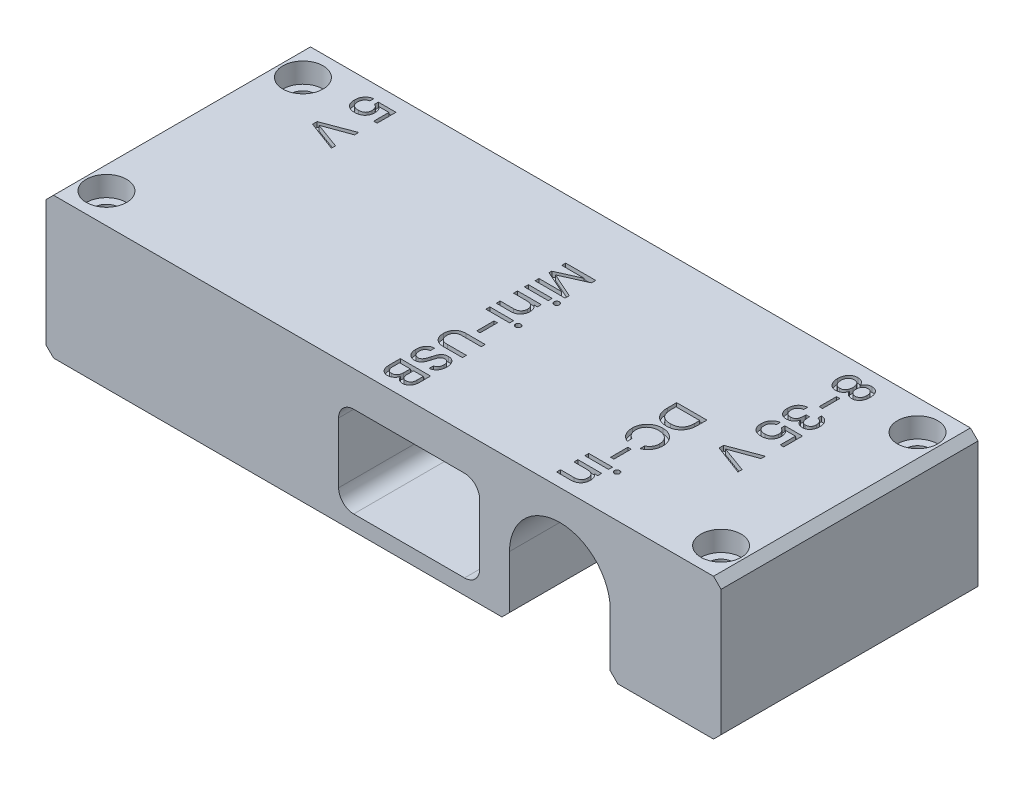
from build123d import *

# Parameters (mm, degrees)
SKETCH1_W           = 67
SKETCH1_H           = 25.5
BOSS_EXTRUDE1_DEPTH = 14
CUT_EXTRUDE1_DEPTH  = 12.5
SKETCH3_W           = 14
SKETCH3_H           = 13
CUT_EXTRUDE2_DEPTH  = 12
CUT_EXTRUDE3_DEPTH  = 74.042795675
SKETCH6_R           = 2
CUT_EXTRUDE4_DEPTH  = 2
SKETCH7_R           = 1.2
CUT_EXTRUDE5_DEPTH  = 12
CHAMFER1_SIZE       = 0.75
SKETCH8_W           = 2.358655044
SKETCH8_H           = 0.391656289
SKETCH8_W_2         = 0.331257783
SKETCH8_H_2         = 1.717310087
CUT_EXTRUDE6_DEPTH  = 0.5
SKETCH9_W           = 0.331257783
SKETCH9_H           = 1.717310087
CUT_EXTRUDE7_DEPTH  = 0.5


with BuildPart() as part:
    # Sketch1 → Boss-Extrude1 (new body)
    with BuildSketch(Plane(origin=(0, 0, 0), x_dir=(1, 0, 0), z_dir=(0, 1, 0))):
        with Locations((33.5, 12.75)):
            Rectangle(SKETCH1_W, SKETCH1_H)
    extrude(amount=BOSS_EXTRUDE1_DEPTH)

    # Sketch2 → Cut-Extrude1 (cut)
    with BuildSketch(Plane.XY):
        with BuildLine():
            Line((46, 6), (46, 0))
            Line((46, 0), (56, 0))
            Line((56, 0), (56, 6))
            ThreePointArc((56, 6), (51, 11), (46, 6))
        make_face()
    extrude(amount=-CUT_EXTRUDE1_DEPTH, mode=Mode.SUBTRACT)

    # Sketch3 → Cut-Extrude2 (cut)
    with BuildSketch(Plane.XZ):
        with Locations((51, -19)):
            Rectangle(SKETCH3_W, SKETCH3_H)
    extrude(amount=-CUT_EXTRUDE2_DEPTH, mode=Mode.SUBTRACT)

    # Sketch5 → Cut-Extrude3 (cut, through all)
    with BuildSketch(Plane.XY):
        with BuildLine():
            Line((30.54, 10.5), (41.54, 10.5))
            ThreePointArc((41.54, 10.5), (42.600660172, 10.060660172), (43.04, 9))
            Line((43.04, 9), (43.04, 3))
            ThreePointArc((43.04, 3), (42.600660172, 1.939339828), (41.54, 1.5))
            Line((41.54, 1.5), (30.54, 1.5))
            ThreePointArc((30.54, 1.5), (29.479339828, 1.939339828), (29.04, 3))
            Line((29.04, 3), (29.04, 9))
            ThreePointArc((29.04, 9), (29.479339828, 10.060660172), (30.54, 10.5))
        make_face()
    extrude(amount=-CUT_EXTRUDE3_DEPTH, mode=Mode.SUBTRACT)

    # Sketch6 → Cut-Extrude4 (cut)
    with BuildSketch(Plane(origin=(0, 14, 0), x_dir=(1, 0, 0), z_dir=(0, 1, 0))):
        with Locations(Location((3, 22.5, 0), (0, 0, 270))):
            Circle(SKETCH6_R)
        with Locations(Location((64, 22.5, 0), (0, 0, 270))):
            Circle(SKETCH6_R)
        with Locations(Location((64, 3, 0), (0, 0, 270))):
            Circle(SKETCH6_R)
        with Locations(Location((3, 3, 0), (0, 0, 270))):
            Circle(SKETCH6_R)
    extrude(amount=-CUT_EXTRUDE4_DEPTH, mode=Mode.SUBTRACT)

    # Sketch7 → Cut-Extrude5 (cut)
    with BuildSketch(Plane(origin=(0, 12, 0), x_dir=(1, 0, 0), z_dir=(0, 1, 0))):
        with Locations(Location((3, 22.5, 0), (0, 0, 270))):
            Circle(SKETCH7_R)
        with Locations(Location((64, 22.5, 0), (0, 0, 270))):
            Circle(SKETCH7_R)
        with Locations(Location((64, 3, 0), (0, 0, 270))):
            Circle(SKETCH7_R)
        with Locations(Location((3, 3, 0), (0, 0, 270))):
            Circle(SKETCH7_R)
    extrude(amount=-CUT_EXTRUDE5_DEPTH, mode=Mode.SUBTRACT)

    # Chamfer1
    chamfer1_edges = [part.edges().sort_by_distance(p)[0] for p in [
        (0, 14, -12.75),
        (56, 0, -6.25),
        (46, 0, -6.25),
        (44, 0, -19),
        (58, 0, -19),
        (0, 0, -12.75),
        (67, 0, -12.75),
        (67, 14, -12.75),
    ]]
    chamfer(chamfer1_edges, length=CHAMFER1_SIZE)

    # Sketch8 → Cut-Extrude6 (cut)
    # profile 1 of 16: a face of its own
    with BuildSketch(Plane(origin=(0, 14, 0), x_dir=(1, 0, 0), z_dir=(0, 1, 0))):
        Polygon((34.978206725, 16.539537281), (32, 16.539537281), (32, 16.931193569), (34.221046077, 16.931193569), (32, 17.921230929), (32, 18.196448862), (34.225404732, 19.190844877), (32, 19.190844877), (32, 19.582501166), (34.978206725, 19.582501166), (34.978206725, 19.160334292), (32.51618929, 18.058839896), (34.978206725, 16.956722835), align=None)
    # profile 2 of 16: a face of its own
    with BuildSketch(Plane(origin=(0, 14, 0), x_dir=(1, 0, 0), z_dir=(0, 1, 0))):
        with BuildLine():
            add(Edge.make_bspline(
                [(34.741594022, 15.674032922), (34.742522669, 15.692194333), (34.744325891, 15.72745969), (34.759324862, 15.778177319), (34.783891202, 15.82415478), (34.817760006, 15.864613609), (34.858521559, 15.898065848), (34.904555093, 15.92282739), (34.955295309, 15.937795074), (34.990557519, 15.939602654), (35.00871731, 15.940533545)],
                knots=[0, 0, 0, 0, 1.036069038, 2.011811935, 2.993302999, 3.995424963, 5.006697001, 5.988188065, 6.963930962, 8, 8, 8, 8], degree=3))
            add(Edge.make_bspline(
                [(35.00871731, 15.940533545), (35.026670464, 15.939588888), (35.061726358, 15.937744323), (35.112222202, 15.922789288), (35.158280315, 15.898289276), (35.198410193, 15.8641816), (35.233003636, 15.824405007), (35.257448921, 15.778142877), (35.272496274, 15.727468901), (35.274292757, 15.692197464), (35.275217933, 15.674032922)],
                knots=[0, 0, 0, 0, 1.025971339, 2.003343916, 2.986474261, 3.990269963, 5.001697604, 5.984827949, 6.962200526, 8, 8, 8, 8], degree=3))
            add(Edge.make_bspline(
                [(35.275217933, 15.674032922), (35.27424745, 15.656707253), (35.272341667, 15.622684029), (35.257615117, 15.573710112), (35.232568389, 15.529054966), (35.198430108, 15.490054977), (35.158226445, 15.456608866), (35.112173615, 15.432678861), (35.06162853, 15.418579057), (35.0266566, 15.416627844), (35.00871731, 15.415626944)],
                knots=[0, 0, 0, 0, 1.006440991, 1.976395179, 2.943566783, 3.962094132, 4.97438049, 5.967708632, 6.957510677, 8, 8, 8, 8], degree=3))
            add(Edge.make_bspline(
                [(35.00871731, 15.415626944), (34.990571598, 15.41661506), (34.955393616, 15.418530659), (34.904604143, 15.432640802), (34.858571608, 15.456831752), (34.817746521, 15.489622636), (34.784317445, 15.529301498), (34.759160077, 15.573676468), (34.744479895, 15.622692821), (34.742567747, 15.65671022), (34.741594022, 15.674032922)],
                knots=[0, 0, 0, 0, 1.052721404, 2.040846585, 3.032491889, 4.052430234, 5.061420034, 6.026953113, 6.995264062, 8, 8, 8, 8], degree=3))
        make_face()
    # profile 3 of 16: a face of its own
    with BuildSketch(Plane(origin=(0, 14, 0), x_dir=(1, 0, 0), z_dir=(0, 1, 0))):
        with Locations((33.179327522, 15.680570905)):
            Rectangle(SKETCH8_W, SKETCH8_H)
    # profile 4 of 16: a face of its own
    with BuildSketch(Plane(origin=(0, 14, 0), x_dir=(1, 0, 0), z_dir=(0, 1, 0))):
        with BuildLine():
            add(Edge.make_bspline(
                [(34.401618929, 13.650994317), (34.400701756, 13.615889147), (34.398910902, 13.547343469), (34.387263642, 13.44699343), (34.366358923, 13.352114695), (34.338726983, 13.261727489), (34.301624609, 13.17671304), (34.256617591, 13.096566181), (34.203529301, 13.021533376), (34.142440496, 12.952368885), (34.073855786, 12.889712462), (33.997271022, 12.835287372), (33.913668392, 12.789229304), (33.822818695, 12.751563298), (33.72495231, 12.722412479), (33.619603416, 12.702213957), (33.507364372, 12.689568814), (33.430088844, 12.687943448), (33.390410959, 12.687108887)],
                knots=[0, 0, 0, 0, 1.064717115, 2.078946093, 3.058030579, 4.007696767, 4.940864063, 5.865307288, 6.790971267, 7.723033922, 8.658808932, 9.602027832, 10.565590544, 11.547564354, 12.579166272, 13.656885025, 14.796904389, 16, 16, 16, 16], degree=3))
            Line((33.390410959, 12.687108887), (32, 12.687108887))
            Line((32, 12.687108887), (32, 13.074406521))
            Line((32, 13.074406521), (33.334371108, 13.074406521))
            add(Edge.make_bspline(
                [(33.334371108, 13.074406521), (33.363042421, 13.074726297), (33.418661233, 13.075346624), (33.499347651, 13.084660636), (33.57483931, 13.097842647), (33.645138961, 13.117181661), (33.71007274, 13.142264583), (33.770591265, 13.171969266), (33.825350585, 13.208261423), (33.874937277, 13.249726643), (33.919258605, 13.295670933), (33.957401194, 13.346352363), (33.989291524, 13.401313429), (34.016250356, 13.459746986), (34.036826059, 13.522435211), (34.05095195, 13.589045716), (34.059852743, 13.659679543), (34.061036283, 13.708252086), (34.061643836, 13.733186097)],
                knots=[0, 0, 0, 0, 1.234029988, 2.393866087, 3.493155277, 4.531906527, 5.527896847, 6.487276504, 7.429344393, 8.349488254, 9.26615231, 10.172517183, 11.073932102, 11.99788861, 12.939150461, 13.908678183, 14.926450247, 16, 16, 16, 16], degree=3))
            add(Edge.make_bspline(
                [(34.061643836, 13.733186097), (34.060993585, 13.758319912), (34.059721296, 13.807497078), (34.051320831, 13.879349871), (34.035417863, 13.947005034), (34.014200849, 14.010789561), (33.98775894, 14.071181094), (33.953490072, 14.126681747), (33.914143862, 14.178862046), (33.868680915, 14.226770683), (33.817412818, 14.269933545), (33.760498634, 14.307623878), (33.697448896, 14.338492771), (33.629504787, 14.365031726), (33.555686183, 14.384462208), (33.476629042, 14.399070451), (33.392014052, 14.406729376), (33.333761543, 14.408082877), (33.303860523, 14.408777629)],
                knots=[0, 0, 0, 0, 1.046951621, 2.048479888, 3.006840697, 3.936341331, 4.8457236, 5.745687958, 6.646523872, 7.563802754, 8.490283233, 9.432600765, 10.399154002, 11.409005568, 12.465974733, 13.573258391, 14.754353226, 16, 16, 16, 16], degree=3))
            Line((33.303860523, 14.408777629), (32, 14.408777629))
            Line((32, 14.408777629), (32, 14.800433918))
            Line((32, 14.800433918), (34.358655044, 14.800433918))
            Line((34.358655044, 14.800433918), (34.358655044, 14.408777629))
            Line((34.358655044, 14.408777629), (34.023038605, 14.408777629))
            add(Edge.make_bspline(
                [(34.023038605, 14.408777629), (34.052158219, 14.388445783), (34.110090387, 14.347996485), (34.184871113, 14.272307365), (34.250675728, 14.187504795), (34.304721527, 14.09224198), (34.348488608, 13.989986217), (34.378883959, 13.881310625), (34.398185002, 13.767915679), (34.40046451, 13.690300976), (34.401618929, 13.650994317)],
                knots=[0, 0, 0, 0, 0.963266348, 1.916375297, 2.877459914, 3.872878579, 4.883706922, 5.892330276, 6.932606152, 8, 8, 8, 8], degree=3))
        make_face()
    # profile 5 of 16: a face of its own
    with BuildSketch(Plane(origin=(0, 14, 0), x_dir=(1, 0, 0), z_dir=(0, 1, 0))):
        with BuildLine():
            add(Edge.make_bspline(
                [(34.741594022, 11.848379124), (34.742522669, 11.866540535), (34.744325891, 11.901805891), (34.759324862, 11.95252352), (34.783891202, 11.998500982), (34.817760006, 12.038959811), (34.858521559, 12.072412049), (34.904555093, 12.097173592), (34.955295309, 12.112141276), (34.990557519, 12.113948855), (35.00871731, 12.114879746)],
                knots=[0, 0, 0, 0, 1.036069038, 2.011811935, 2.993302999, 3.995424963, 5.006697001, 5.988188065, 6.963930962, 8, 8, 8, 8], degree=3))
            add(Edge.make_bspline(
                [(35.00871731, 12.114879746), (35.026670464, 12.11393509), (35.061726358, 12.112090525), (35.112222202, 12.097135489), (35.158280315, 12.072635477), (35.198410193, 12.038527801), (35.233003636, 11.998751208), (35.257448921, 11.952489078), (35.272496274, 11.901815103), (35.274292757, 11.866543666), (35.275217933, 11.848379124)],
                knots=[0, 0, 0, 0, 1.025971339, 2.003343916, 2.986474261, 3.990269963, 5.001697604, 5.984827949, 6.962200526, 8, 8, 8, 8], degree=3))
            add(Edge.make_bspline(
                [(35.275217933, 11.848379124), (35.27424745, 11.831053455), (35.272341667, 11.797030231), (35.257615117, 11.748056314), (35.232568389, 11.703401168), (35.198430108, 11.664401179), (35.158226445, 11.630955067), (35.112173615, 11.607025063), (35.06162853, 11.592925259), (35.0266566, 11.590974045), (35.00871731, 11.589973146)],
                knots=[0, 0, 0, 0, 1.006440991, 1.976395179, 2.943566783, 3.962094132, 4.97438049, 5.967708632, 6.957510677, 8, 8, 8, 8], degree=3))
            add(Edge.make_bspline(
                [(35.00871731, 11.589973146), (34.990571598, 11.590961262), (34.955393616, 11.592876861), (34.904604143, 11.606987004), (34.858571608, 11.631177954), (34.817746521, 11.663968838), (34.784317445, 11.7036477), (34.759160077, 11.74802267), (34.744479895, 11.797039022), (34.742567747, 11.831056422), (34.741594022, 11.848379124)],
                knots=[0, 0, 0, 0, 1.052721404, 2.040846585, 3.032491889, 4.052430234, 5.061420034, 6.026953113, 6.995264062, 8, 8, 8, 8], degree=3))
        make_face()
    # profile 6 of 16: a face of its own
    with BuildSketch(Plane(origin=(0, 14, 0), x_dir=(1, 0, 0), z_dir=(0, 1, 0))):
        with Locations((33.179327522, 11.854917107)):
            Rectangle(SKETCH8_W, SKETCH8_H)
    # profile 7 of 16: a face of its own
    with BuildSketch(Plane(origin=(0, 14, 0), x_dir=(1, 0, 0), z_dir=(0, 1, 0))):
        with Locations((33.57721046, 10.197694193)):
            Rectangle(SKETCH8_W_2, SKETCH8_H_2)
    # profile 8 of 16: a face of its own
    with BuildSketch(Plane(origin=(0, 14, 0), x_dir=(1, 0, 0), z_dir=(0, 1, 0))):
        with BuildLine():
            Line((35, 8.200807517), (33.102117061, 8.200807517))
            add(Edge.make_bspline(
                [(33.102117061, 8.200807517), (33.069709256, 8.200280389), (33.007033604, 8.199260939), (32.916364498, 8.189445838), (32.83197037, 8.175317258), (32.754387009, 8.153085082), (32.682828486, 8.125940095), (32.617682271, 8.092342302), (32.559114365, 8.052146504), (32.507407542, 8.005768437), (32.461526205, 7.954465148), (32.422217306, 7.897816354), (32.38834672, 7.836879411), (32.361507002, 7.770466946), (32.340744122, 7.699693908), (32.324652919, 7.624217515), (32.316380153, 7.543874804), (32.315100765, 7.488702351), (32.314445828, 7.460458825)],
                knots=[0, 0, 0, 0, 1.258915428, 2.434701922, 3.540662062, 4.579902709, 5.565519267, 6.510702257, 7.421283961, 8.318188166, 9.203704504, 10.089808395, 10.992316612, 11.907494993, 12.867023562, 13.855704681, 14.902306188, 16, 16, 16, 16], degree=3))
            add(Edge.make_bspline(
                [(32.314445828, 7.460458825), (32.315088124, 7.43242095), (32.316337897, 7.377865107), (32.324735729, 7.298370375), (32.340608404, 7.223873677), (32.361757781, 7.153848309), (32.38831976, 7.087765387), (32.422226245, 7.026842374), (32.461516877, 6.970176979), (32.507436173, 6.918926462), (32.558919932, 6.872429122), (32.617894804, 6.833038443), (32.682797614, 6.799291088), (32.754395919, 6.772204244), (32.831967761, 6.749955234), (32.916365261, 6.735831581), (33.007033393, 6.726015056), (33.069709184, 6.72499581), (33.102117061, 6.724468787)],
                knots=[0, 0, 0, 0, 1.093185431, 2.127110335, 3.111093689, 4.058252241, 4.9764139, 5.881864092, 6.770856485, 7.659259409, 8.559087322, 9.468074302, 10.416338379, 11.405167827, 12.447796168, 13.557361491, 14.736980788, 16, 16, 16, 16], degree=3))
            Line((33.102117061, 6.724468787), (35, 6.724468787))
            Line((35, 6.724468787), (35, 6.332812498))
            Line((35, 6.332812498), (33.105853051, 6.332812498))
            add(Edge.make_bspline(
                [(33.105853051, 6.332812498), (33.07533082, 6.33333546), (33.015247138, 6.33436492), (32.927066207, 6.341133375), (32.842603006, 6.352862226), (32.761979597, 6.369868682), (32.684794513, 6.390939373), (32.611124154, 6.416187269), (32.541470679, 6.447049164), (32.475815452, 6.482423832), (32.413786323, 6.52176204), (32.356216589, 6.56499148), (32.301438289, 6.609966826), (32.252181084, 6.660043962), (32.206212412, 6.71233232), (32.164721929, 6.768458922), (32.127487415, 6.827680986), (32.082377366, 6.910782216), (32.037867541, 7.022026728), (31.997989967, 7.162354375), (31.974873279, 7.311088614), (31.971721578, 7.41285025), (31.97011208, 7.46481748)],
                knots=[0, 0, 0, 0, 1.009713022, 1.987642202, 2.923721985, 3.828662033, 4.711503244, 5.569235585, 6.402347423, 7.228726188, 8.034451244, 8.829574193, 9.609370341, 10.376488014, 11.150306066, 11.911098224, 12.682597624, 13.46293771, 15.03638904, 16.634103178, 18.281117138, 20, 20, 20, 20], degree=3))
            add(Edge.make_bspline(
                [(31.97011208, 7.46481748), (31.971730643, 7.516576682), (31.974906307, 7.618129598), (31.99799157, 7.766656394), (32.037860372, 7.906991027), (32.082398413, 8.018214293), (32.127451414, 8.101358293), (32.164946227, 8.16059346), (32.205820697, 8.217196634), (32.252208887, 8.268978687), (32.301649718, 8.318403862), (32.356013224, 8.363458189), (32.413837791, 8.405967942), (32.475811203, 8.444769381), (32.541631942, 8.479378084), (32.611114782, 8.510335466), (32.684704476, 8.535705383), (32.762005789, 8.556028536), (32.84267487, 8.572253641), (32.927057559, 8.584190105), (33.015249423, 8.590898921), (33.075331589, 8.591936646), (33.105853051, 8.592463806)],
                knots=[0, 0, 0, 0, 1.714209427, 3.363323989, 4.963075851, 6.538533962, 7.319869294, 8.092352664, 8.859648331, 9.629281256, 10.392531425, 11.173322125, 11.965381963, 12.768464562, 13.592663498, 14.426837888, 15.285664181, 16.167838301, 17.0725491, 18.009822759, 18.98899919, 20, 20, 20, 20], degree=3))
            Line((33.105853051, 8.592463806), (35, 8.592463806))
            Line((35, 8.592463806), (35, 8.200807517))
        make_face()
    # profile 9 of 16: a face of its own
    with BuildSketch(Plane(origin=(0, 14, 0), x_dir=(1, 0, 0), z_dir=(0, 1, 0))):
        with BuildLine():
            add(Edge.make_bspline(
                [(31.97011208, 4.723223457), (31.971488126, 4.7714366), (31.974180457, 4.865768948), (31.993454014, 5.003437354), (32.026638766, 5.133265231), (32.072343099, 5.254559842), (32.130216145, 5.365473839), (32.198304121, 5.465058459), (32.277258871, 5.551700904), (32.3660776, 5.624961202), (32.463574467, 5.684255556), (32.569658011, 5.726560832), (32.68269027, 5.754545906), (32.760937664, 5.758547491), (32.800747198, 5.760583358)],
                knots=[0, 0, 0, 0, 1.170851366, 2.290851677, 3.368022571, 4.419441493, 5.431851506, 6.399495151, 7.341522011, 8.269045141, 9.18719167, 10.100843302, 11.033775573, 12, 12, 12, 12], degree=3))
            Line((32.800747198, 5.760583358), (32.800747198, 5.343397804))
            add(Edge.make_bspline(
                [(32.800747198, 5.343397804), (32.783461254, 5.341242854), (32.749226926, 5.336975037), (32.699528168, 5.324798267), (32.651671964, 5.309383011), (32.606222999, 5.289143218), (32.562378657, 5.265702585), (32.521009782, 5.23731632), (32.481926871, 5.204717443), (32.444314711, 5.168980467), (32.410538564, 5.128327073), (32.381419155, 5.083252913), (32.355895312, 5.03428308), (32.336570447, 4.980241408), (32.32001386, 4.922329546), (32.309013024, 4.859737751), (32.303031377, 4.792872675), (32.301934599, 4.746896703), (32.301369863, 4.723223457)],
                knots=[0, 0, 0, 0, 0.944878342, 1.871305023, 2.772729817, 3.670768436, 4.568170726, 5.468186162, 6.388563991, 7.328795859, 8.280901422, 9.249660843, 10.237302192, 11.271161951, 12.359164733, 13.503964636, 14.714779592, 16, 16, 16, 16], degree=3))
            add(Edge.make_bspline(
                [(32.301369863, 4.723223457), (32.30196044, 4.700592546), (32.303116721, 4.656283841), (32.308836199, 4.591630348), (32.320649494, 4.530826379), (32.334776279, 4.473374614), (32.355466552, 4.420198267), (32.378616016, 4.369864128), (32.407662844, 4.323905535), (32.439935941, 4.281399597), (32.475784465, 4.243238527), (32.515550703, 4.211180051), (32.556447511, 4.182443119), (32.600750242, 4.160297549), (32.646967285, 4.14160202), (32.696283852, 4.129669854), (32.747774426, 4.121808696), (32.782866718, 4.120930961), (32.800747198, 4.120483731)],
                knots=[0, 0, 0, 0, 1.234377365, 2.416768003, 3.5332522, 4.609255081, 5.637105389, 6.639406037, 7.625475066, 8.594247894, 9.54682282, 10.471286347, 11.375297089, 12.26610676, 13.165572564, 14.08781682, 15.025690529, 16, 16, 16, 16], degree=3))
            add(Edge.make_bspline(
                [(32.800747198, 4.120483731), (32.828240304, 4.121671017), (32.880920847, 4.123946018), (32.956228034, 4.141536959), (33.023172444, 4.171747442), (33.081801553, 4.213624687), (33.131861148, 4.264858536), (33.176374051, 4.321552587), (33.213905516, 4.384461963), (33.245376905, 4.454369677), (33.273742297, 4.533302767), (33.303674862, 4.622712776), (33.334113509, 4.724751611), (33.353833186, 4.797068852), (33.364259029, 4.835303158)],
                knots=[0, 0, 0, 0, 0.995476446, 1.907468756, 2.782500279, 3.640070209, 4.501489082, 5.369447822, 6.246415971, 7.148213227, 8.142780354, 9.284226966, 10.564164025, 12, 12, 12, 12], degree=3))
            add(Edge.make_bspline(
                [(33.364259029, 4.835303158), (33.376765054, 4.882521086), (33.400567317, 4.972389244), (33.440041016, 5.098676983), (33.478414379, 5.210357996), (33.51680987, 5.309421497), (33.561590754, 5.398250771), (33.617560721, 5.478294264), (33.684445715, 5.551734124), (33.748272313, 5.60729591), (33.805319516, 5.646906779), (33.852594904, 5.672530688), (33.903256071, 5.694321504), (33.9573714, 5.712411474), (34.015146725, 5.725989411), (34.076321407, 5.735814845), (34.140998347, 5.742300992), (34.18533049, 5.74286216), (34.207970112, 5.743148738)],
                knots=[0, 0, 0, 0, 1.715511147, 3.265069795, 4.646093054, 5.863134058, 6.994538405, 8.131098308, 9.282063266, 10.476090914, 11.094863934, 11.7180021, 12.361284571, 13.029847845, 13.719464125, 14.443371456, 15.205057997, 16, 16, 16, 16], degree=3))
            add(Edge.make_bspline(
                [(34.207970112, 5.743148738), (34.247716135, 5.74152613), (34.325817409, 5.738337692), (34.439407139, 5.71522622), (34.545638642, 5.67517025), (34.644062737, 5.620379399), (34.733714658, 5.551218037), (34.813476636, 5.469352087), (34.880923772, 5.373633094), (34.938225423, 5.26710046), (34.983476387, 5.149944966), (35.015743867, 5.023732871), (35.035390781, 4.889264151), (35.037516258, 4.796766084), (35.03860523, 4.749375388)],
                knots=[0, 0, 0, 0, 0.984322557, 1.934202226, 2.85673366, 3.786614807, 4.714233033, 5.652350767, 6.606880783, 7.605270089, 8.642209907, 9.709701032, 10.826582358, 12, 12, 12, 12], degree=3))
            add(Edge.make_bspline(
                [(35.03860523, 4.749375388), (35.038079061, 4.714896622), (35.037049746, 4.647447835), (35.026908567, 4.548772694), (35.010151506, 4.455122209), (34.986990261, 4.366248507), (34.957982855, 4.281579571), (34.921195403, 4.20204487), (34.877793134, 4.12739082), (34.82893029, 4.057743966), (34.774291754, 3.994316147), (34.714729078, 3.937907053), (34.651171319, 3.888592084), (34.583327057, 3.846265392), (34.510746368, 3.812032436), (34.433906489, 3.785332387), (34.352757771, 3.765661229), (34.29689528, 3.758590236), (34.268368618, 3.754979373)],
                knots=[0, 0, 0, 0, 1.189421328, 2.326795229, 3.418351111, 4.469303369, 5.493085187, 6.502512384, 7.487689322, 8.469293316, 9.434110662, 10.371340286, 11.295341661, 12.20558459, 13.125022692, 14.058221084, 15.008413864, 16, 16, 16, 16], degree=3))
            Line((34.268368618, 3.754979373), (34.268368618, 4.185240892))
            add(Edge.make_bspline(
                [(34.268368618, 4.185240892), (34.296545666, 4.190448155), (34.353225572, 4.200922892), (34.432903071, 4.239606223), (34.506808847, 4.294718563), (34.563048588, 4.35261998), (34.602714142, 4.407136938), (34.629838556, 4.451784124), (34.653196587, 4.499732424), (34.670690281, 4.55161649), (34.685191892, 4.606095403), (34.695832529, 4.663725467), (34.702098698, 4.724742781), (34.702687677, 4.766587513), (34.702988792, 4.787980618)],
                knots=[0, 0, 0, 0, 1.264967458, 2.54456161, 3.880049715, 5.337036035, 6.100454803, 6.863873571, 7.649570672, 8.45818786, 9.285829072, 10.146291052, 11.052291923, 12, 12, 12, 12], degree=3))
            add(Edge.make_bspline(
                [(34.702988792, 4.787980618), (34.702698065, 4.807923678), (34.70212722, 4.847082029), (34.695648576, 4.904305804), (34.685691336, 4.958820607), (34.672277578, 5.01064573), (34.654055471, 5.059331452), (34.632097298, 5.105135919), (34.606470997, 5.148410277), (34.576969347, 5.188779011), (34.543109311, 5.224647951), (34.506978483, 5.257143928), (34.46690546, 5.283657506), (34.424039148, 5.305965829), (34.377724914, 5.322689378), (34.328172509, 5.334261798), (34.27567251, 5.342106648), (34.239548203, 5.342960486), (34.221046077, 5.343397804)],
                knots=[0, 0, 0, 0, 1.153559129, 2.265022109, 3.32744849, 4.358733701, 5.358196334, 6.330517839, 7.294495641, 8.264960932, 9.216740757, 10.144343228, 11.070389318, 11.98892807, 12.935007426, 13.910882966, 14.929997326, 16, 16, 16, 16], degree=3))
            add(Edge.make_bspline(
                [(34.221046077, 5.343397804), (34.194999629, 5.342441194), (34.144555963, 5.340588548), (34.072635301, 5.322923573), (34.008343557, 5.29326068), (33.952520478, 5.25190433), (33.904512174, 5.202308076), (33.861723068, 5.147607222), (33.824569166, 5.087728186), (33.794481293, 5.020068394), (33.767500883, 4.943257502), (33.736945874, 4.85537643), (33.706527557, 4.753079666), (33.685500006, 4.68027348), (33.674346202, 4.641654342)],
                knots=[0, 0, 0, 0, 0.966639634, 1.872072825, 2.731319168, 3.581376936, 4.437675598, 5.289376464, 6.158501702, 7.048994857, 8.034830836, 9.183676047, 10.506115877, 12, 12, 12, 12], degree=3))
            add(Edge.make_bspline(
                [(33.674346202, 4.641654342), (33.660901891, 4.594464437), (33.635335382, 4.504725277), (33.594892156, 4.377756444), (33.55454443, 4.265415294), (33.514842117, 4.165180727), (33.469760729, 4.075040401), (33.412744282, 3.994264103), (33.34557777, 3.919736137), (33.281626928, 3.863377878), (33.225022916, 3.822245768), (33.177542668, 3.79645887), (33.126481122, 3.774364414), (33.07178129, 3.756662262), (33.013595875, 3.742033432), (32.951476456, 3.732446012), (32.885776959, 3.725930258), (32.840614706, 3.725374943), (32.817559153, 3.725091452)],
                knots=[0, 0, 0, 0, 1.705923065, 3.244085852, 4.631897398, 5.855366398, 6.991416575, 8.126480806, 9.281306938, 10.472688407, 11.083389886, 11.710000124, 12.346750211, 13.015374214, 13.706704909, 14.430384023, 15.198703304, 16, 16, 16, 16], degree=3))
            add(Edge.make_bspline(
                [(32.817559153, 3.725091452), (32.78154476, 3.726568431), (32.709688235, 3.729515323), (32.603824858, 3.752095221), (32.501342953, 3.788694554), (32.402610047, 3.838965138), (32.310368322, 3.904643583), (32.226257955, 3.984442703), (32.15167382, 4.078414746), (32.098369041, 4.166801436), (32.061423526, 4.243691472), (32.037356457, 4.305013048), (32.015805228, 4.368409812), (31.999260913, 4.434702556), (31.986125937, 4.503301591), (31.97689769, 4.57441185), (31.971142241, 4.647992864), (31.970458967, 4.697890981), (31.97011208, 4.723223457)],
                knots=[0, 0, 0, 0, 1.181567915, 2.357484201, 3.536298608, 4.746054818, 5.982456489, 7.240373417, 8.53962781, 9.909124525, 10.619201155, 11.337855941, 12.070426109, 12.81571846, 13.578739294, 14.362173383, 15.168501621, 16, 16, 16, 16], degree=3))
        make_face()
    # profile 10 of 16: a face of its own
    with BuildSketch(Plane(origin=(0, 14, 0), x_dir=(1, 0, 0), z_dir=(0, 1, 0))):
        with BuildLine():
            add(Edge.make_bspline(
                [(33.54483188, 1.661579622), (33.539508166, 1.634832213), (33.528871721, 1.581392579), (33.500331734, 1.504218129), (33.461091165, 1.430876396), (33.412778035, 1.361317631), (33.355443854, 1.297628128), (33.291631011, 1.239960698), (33.221325911, 1.189128253), (33.145154318, 1.14589177), (33.06455638, 1.110665294), (32.980303883, 1.086725598), (32.89370404, 1.070889405), (32.834856844, 1.069089724), (32.805105853, 1.068179871)],
                knots=[0, 0, 0, 0, 0.954081116, 1.90619388, 2.868767158, 3.860943345, 4.864900523, 5.863447769, 6.868246796, 7.89705713, 8.92604723, 9.940581488, 10.958833288, 12, 12, 12, 12], degree=3))
            add(Edge.make_bspline(
                [(32.805105853, 1.068179871), (32.767845633, 1.069611473), (32.69453733, 1.072428104), (32.587739146, 1.094831395), (32.486796875, 1.13146561), (32.391777675, 1.181764217), (32.304890361, 1.246934189), (32.227313232, 1.325926004), (32.160232879, 1.418424038), (32.101955013, 1.522616048), (32.056150076, 1.638849291), (32.023172082, 1.765496685), (32.003967735, 1.902172547), (32.001349589, 1.996511758), (32, 2.045141266)],
                knots=[0, 0, 0, 0, 0.943646366, 1.856594369, 2.751777284, 3.657728248, 4.570858064, 5.493287855, 6.452751437, 7.458188524, 8.51112707, 9.609602875, 10.767809955, 12, 12, 12, 12], degree=3))
            Line((32, 2.045141266), (32, 3.164070282))
            Line((32, 3.164070282), (35, 3.164070282))
            Line((35, 3.164070282), (35, 2.088105151))
            add(Edge.make_bspline(
                [(35, 2.088105151), (34.998944862, 2.03905197), (34.996901718, 1.944066537), (34.977278744, 1.807364792), (34.945954402, 1.681647283), (34.901643893, 1.568007879), (34.84709411, 1.466522368), (34.782385575, 1.378418263), (34.709199863, 1.303175841), (34.626751646, 1.242610221), (34.53789743, 1.194805261), (34.44281044, 1.161003141), (34.342091161, 1.140567404), (34.273030859, 1.137987157), (34.237858032, 1.136673021)],
                knots=[0, 0, 0, 0, 1.287751119, 2.493571179, 3.618798581, 4.683831512, 5.688894333, 6.636436569, 7.546230431, 8.434871091, 9.31291329, 10.187173183, 11.076716406, 12, 12, 12, 12], degree=3))
            add(Edge.make_bspline(
                [(34.237858032, 1.136673021), (34.216052553, 1.137245052), (34.1733915, 1.138364193), (34.110871281, 1.144368945), (34.051239676, 1.155554776), (33.994769582, 1.171996486), (33.940549396, 1.191725574), (33.889568842, 1.216780821), (33.841347127, 1.246080665), (33.781554127, 1.291237268), (33.713729658, 1.356717735), (33.644375055, 1.447361355), (33.585772737, 1.549077078), (33.558680114, 1.623525666), (33.54483188, 1.661579622)],
                knots=[0, 0, 0, 0, 0.838723696, 1.640910281, 2.412696977, 3.168130051, 3.900567858, 4.628818279, 5.348886344, 6.067271281, 7.506810034, 8.958074049, 10.44513751, 12, 12, 12, 12], degree=3))
        make_face()
        with BuildLine():
            Line((33.704234122, 2.772413993), (33.704234122, 2.113634416))
            add(Edge.make_bspline(
                [(33.704234122, 2.113634416), (33.704508996, 2.091407975), (33.705044497, 2.048107134), (33.711616759, 1.985103038), (33.721206777, 1.925682608), (33.735556308, 1.8702972), (33.753684398, 1.818839054), (33.775412372, 1.77110408), (33.801673803, 1.727189677), (33.832258181, 1.687573349), (33.865804549, 1.651548802), (33.903371671, 1.621219031), (33.943792771, 1.595126069), (33.987441874, 1.57426868), (34.033818288, 1.557093264), (34.083365856, 1.545383291), (34.135963896, 1.538549986), (34.172042404, 1.537556077), (34.190535492, 1.53704662)],
                knots=[0, 0, 0, 0, 1.247098428, 2.429557224, 3.551947019, 4.622910538, 5.636240278, 6.611064612, 7.562137534, 8.50121789, 9.415989891, 10.318512595, 11.204030826, 12.11067997, 13.028414803, 13.975053128, 14.962054589, 16, 16, 16, 16], degree=3))
            add(Edge.make_bspline(
                [(34.190535492, 1.53704662), (34.209026599, 1.537568877), (34.245307061, 1.53859357), (34.298135428, 1.545304475), (34.3478542, 1.557136396), (34.394150214, 1.574066745), (34.43745818, 1.595527114), (34.478219025, 1.620785193), (34.51526441, 1.651809301), (34.548851542, 1.687529879), (34.579356817, 1.727215742), (34.605978893, 1.771367435), (34.627348482, 1.820131239), (34.645412211, 1.872618947), (34.659947942, 1.928993338), (34.669481645, 1.989674031), (34.67604127, 2.054544805), (34.676566337, 2.099295321), (34.676836862, 2.122351726)],
                knots=[0, 0, 0, 0, 1.027619459, 2.016239912, 2.953460649, 3.862065439, 4.749333634, 5.635776707, 6.520416843, 7.426088276, 8.355826235, 9.297437452, 10.283565043, 11.308591791, 12.380072518, 13.514051639, 14.719187175, 16, 16, 16, 16], degree=3))
            Line((34.676836862, 2.122351726), (34.676836862, 2.772413993))
            Line((34.676836862, 2.772413993), (33.704234122, 2.772413993))
        make_face(mode=Mode.SUBTRACT)
        with BuildLine():
            add(Edge.make_bspline(
                [(32.322540473, 2.079387841), (32.322761257, 2.055705255), (32.323192214, 2.009478266), (32.330528621, 1.942337309), (32.340769429, 1.878993366), (32.355751857, 1.819615133), (32.374903138, 1.764092635), (32.398569761, 1.712694856), (32.426892115, 1.665618205), (32.459034007, 1.622635729), (32.495580845, 1.584398336), (32.535231229, 1.55067396), (32.578513665, 1.522365505), (32.625365723, 1.499915817), (32.675177577, 1.481817453), (32.728361206, 1.46865912), (32.784966359, 1.461195086), (32.823763651, 1.460297598), (32.843711083, 1.45983616)],
                knots=[0, 0, 0, 0, 1.238214825, 2.416921152, 3.528982037, 4.592877743, 5.616161795, 6.597454761, 7.54712218, 8.485236418, 9.39916182, 10.308366735, 11.202799601, 12.096309351, 13.020241534, 13.970901551, 14.956749218, 16, 16, 16, 16], degree=3))
            add(Edge.make_bspline(
                [(32.843711083, 1.45983616), (32.864078618, 1.460241615), (32.903740575, 1.461031163), (32.961583667, 1.469294206), (33.015948999, 1.483145229), (33.067376616, 1.501520285), (33.114984863, 1.52627712), (33.159655899, 1.555651626), (33.200963737, 1.590663418), (33.238175102, 1.631349807), (33.271637701, 1.676371019), (33.302038051, 1.724647792), (33.325848922, 1.777795709), (33.346812236, 1.833565118), (33.361874839, 1.893392871), (33.374320597, 1.956265647), (33.379932951, 2.02324821), (33.38109689, 2.069004341), (33.381693649, 2.092463806)],
                knots=[0, 0, 0, 0, 1.042565311, 2.030200613, 2.984082461, 3.912208973, 4.820213278, 5.72528863, 6.645345387, 7.585626922, 8.542288307, 9.515808458, 10.500235284, 11.519178214, 12.563367881, 13.655785803, 14.798106183, 16, 16, 16, 16], degree=3))
            Line((33.381693649, 2.092463806), (33.381693649, 2.772413993))
            Line((33.381693649, 2.772413993), (32.322540473, 2.772413993))
            Line((32.322540473, 2.772413993), (32.322540473, 2.079387841))
        make_face(mode=Mode.SUBTRACT)
    # profile 11 of 16: a face of its own
    with BuildSketch(Plane(origin=(0, 14, 0), x_dir=(1, 0, 0), z_dir=(0, 1, 0))):
        with BuildLine():
            add(Edge.make_bspline(
                [(52.5, 12.160121679), (52.499302046, 12.119845574), (52.497929921, 12.040665844), (52.490091042, 11.92400374), (52.475524435, 11.811601846), (52.455944909, 11.702955287), (52.429570514, 11.598720481), (52.398643106, 11.498267955), (52.361036212, 11.402293443), (52.318234533, 11.310352734), (52.270346441, 11.222739726), (52.21672665, 11.140760516), (52.158591052, 11.063684479), (52.09572176, 10.991893336), (52.027476864, 10.925653394), (51.954450015, 10.864732215), (51.877062509, 10.80810471), (51.79414148, 10.757940372), (51.707026006, 10.71334691), (51.616366131, 10.673616997), (51.521761208, 10.640874524), (51.423331646, 10.614043196), (51.321257273, 10.592818171), (51.215382039, 10.578044962), (51.105796763, 10.569207974), (51.031564879, 10.567973212), (50.99377335, 10.567344593)],
                knots=[0, 0, 0, 0, 1.169199311, 2.298556047, 3.391837293, 4.457733203, 5.50105043, 6.510990927, 7.506742908, 8.490557866, 9.453188169, 10.402357103, 11.33138828, 12.253517315, 13.169544502, 14.089052139, 15.012164736, 15.950371368, 16.898851695, 17.851341882, 18.821184969, 19.801914325, 20.810991871, 21.845364217, 22.903072706, 24, 24, 24, 24], degree=3))
            add(Edge.make_bspline(
                [(50.99377335, 10.567344593), (50.955982759, 10.567983491), (50.881545812, 10.569241942), (50.77194655, 10.577951873), (50.666089769, 10.592883783), (50.564222223, 10.614058271), (50.465945472, 10.640743008), (50.371656563, 10.673781025), (50.281268817, 10.713180369), (50.194651744, 10.757968134), (50.112327908, 10.808096113), (50.03560695, 10.864772028), (49.963174625, 10.925454148), (49.89616316, 10.992117362), (49.833984836, 11.063724167), (49.776227048, 11.140397859), (49.724929976, 11.223182581), (49.677175073, 11.310155885), (49.636011659, 11.402490215), (49.598874544, 11.498276687), (49.568327314, 11.598639979), (49.543876643, 11.703151771), (49.523466277, 11.811519654), (49.510421845, 11.92409671), (49.500998655, 12.040617003), (49.500336654, 12.119835715), (49.5, 12.160121679)],
                knots=[0, 0, 0, 0, 1.099985767, 2.166665845, 3.197940315, 4.20983139, 5.193295233, 6.160139751, 7.115285688, 8.061041902, 8.996709761, 9.91751357, 10.834961661, 11.74491944, 12.665643964, 13.593634258, 14.535678122, 15.498095448, 16.479608838, 17.475959814, 18.486930635, 19.530292106, 20.599159967, 21.694740154, 22.827680808, 24, 24, 24, 24], degree=3))
            Line((49.5, 12.160121679), (49.5, 13.094119188))
            Line((49.5, 13.094119188), (52.5, 13.094119188))
            Line((52.5, 13.094119188), (52.5, 12.160121679))
        make_face()
        with BuildLine():
            add(Edge.make_bspline(
                [(49.822540473, 12.160121679), (49.823476705, 12.113171992), (49.825299888, 12.0217439), (49.83999127, 11.888956423), (49.862672506, 11.764425801), (49.897876032, 11.64911903), (49.9399632, 11.541486478), (49.993482998, 11.443075092), (50.056160774, 11.353098242), (50.128508883, 11.271987116), (50.209921238, 11.200339912), (50.298775871, 11.137369456), (50.396048181, 11.085173173), (50.500766321, 11.041992707), (50.613190568, 11.008360223), (50.733347973, 10.985143096), (50.860991447, 10.970483959), (50.948692332, 10.968657202), (50.99377335, 10.967718192)],
                knots=[0, 0, 0, 0, 1.183241047, 2.304200094, 3.364241905, 4.369075645, 5.338747133, 6.27288537, 7.18590346, 8.097526174, 9.005673676, 9.914408836, 10.836853572, 11.782294629, 12.76557783, 13.789666602, 14.863818981, 16, 16, 16, 16], degree=3))
            add(Edge.make_bspline(
                [(50.99377335, 10.967718192), (51.039063253, 10.968658206), (51.127386995, 10.970491408), (51.256035729, 10.985215867), (51.377592516, 11.008130737), (51.490949671, 11.042886569), (51.597193867, 11.085384856), (51.694928201, 11.139152434), (51.785883571, 11.201228005), (51.86812724, 11.273881595), (51.94208307, 11.355141662), (52.006615773, 11.445326881), (52.06083493, 11.544313622), (52.105112312, 11.651457705), (52.139462805, 11.766849424), (52.163143849, 11.890561942), (52.178617377, 12.022537664), (52.18031956, 12.11337573), (52.181195517, 12.160121679)],
                knots=[0, 0, 0, 0, 1.135148871, 2.213751571, 3.242434121, 4.231789317, 5.181671245, 6.106112828, 7.022670908, 7.937084643, 8.850668871, 9.771941635, 10.710510518, 11.673978242, 12.67330022, 13.723409851, 14.828449653, 16, 16, 16, 16], degree=3))
            Line((52.181195517, 12.160121679), (52.181195517, 12.702462899))
            Line((52.181195517, 12.702462899), (49.822540473, 12.702462899))
            Line((49.822540473, 12.702462899), (49.822540473, 12.160121679))
        make_face(mode=Mode.SUBTRACT)
    # profile 12 of 16: a face of its own
    with BuildSketch(Plane(origin=(0, 14, 0), x_dir=(1, 0, 0), z_dir=(0, 1, 0))):
        with BuildLine():
            add(Edge.make_bspline(
                [(51.001867995, 10.211802874), (51.038001527, 10.211209312), (51.10956047, 10.21003382), (51.21542964, 10.200532506), (51.318476026, 10.184732704), (51.418936341, 10.164044133), (51.516393956, 10.135670817), (51.610940468, 10.1013706), (51.703150516, 10.06158398), (51.791668121, 10.014779188), (51.87682922, 9.963110114), (51.958121713, 9.907515103), (52.033489265, 9.84561405), (52.10532627, 9.78086064), (52.171365229, 9.710434626), (52.233418615, 9.636370081), (52.290011805, 9.557128569), (52.341356092, 9.473693254), (52.388407738, 9.387616416), (52.428035253, 9.298020066), (52.462363911, 9.20661515), (52.490861758, 9.112722243), (52.511467295, 9.016172525), (52.527302636, 8.917493102), (52.53684272, 8.816391292), (52.538013711, 8.748145046), (52.53860523, 8.713670869)],
                knots=[0, 0, 0, 0, 1.085079975, 2.148895281, 3.189164786, 4.214895926, 5.226974448, 6.234589537, 7.233995812, 8.240549857, 9.239042038, 10.224647887, 11.195256994, 12.16596618, 13.127222466, 14.092150224, 15.066056484, 16.048602205, 17.033143024, 18.009738675, 18.988103289, 19.96430098, 20.953468287, 21.950616982, 22.964766608, 24, 24, 24, 24], degree=3))
            add(Edge.make_bspline(
                [(52.53860523, 8.713670869), (52.537939606, 8.673373747), (52.536629716, 8.594072639), (52.524703101, 8.477050125), (52.507445853, 8.363661416), (52.480615527, 8.254440106), (52.448254728, 8.148749195), (52.406324226, 8.047614383), (52.358830125, 7.949632368), (52.30320766, 7.856276027), (52.241146648, 7.767862396), (52.172380247, 7.685440601), (52.097685016, 7.609094361), (52.015800984, 7.539934769), (51.929056441, 7.47559909), (51.835455705, 7.41809106), (51.735777234, 7.366734504), (51.665660173, 7.338292207), (51.630136986, 7.323882576)],
                knots=[0, 0, 0, 0, 1.090237236, 2.145488692, 3.180696364, 4.19160159, 5.186477538, 6.169067641, 7.151304462, 8.131016434, 9.106581271, 10.071741172, 11.032970186, 11.993164676, 12.969456937, 13.953090087, 14.962980434, 16, 16, 16, 16], degree=3))
            Line((51.630136986, 7.323882576), (51.630136986, 7.792749325))
            add(Edge.make_bspline(
                [(51.630136986, 7.792749325), (51.652301712, 7.803438065), (51.695925559, 7.824475273), (51.757984561, 7.861156815), (51.81655442, 7.900658851), (51.870778907, 7.944348909), (51.92071612, 7.99157339), (51.967843946, 8.041080629), (52.009940054, 8.095049261), (52.04900818, 8.151704169), (52.082858227, 8.212154788), (52.113196891, 8.275167906), (52.137809703, 8.341388288), (52.158487227, 8.410208756), (52.174832998, 8.481941609), (52.185672751, 8.55670547), (52.192792072, 8.634248117), (52.193772449, 8.686880054), (52.194271482, 8.713670869)],
                knots=[0, 0, 0, 0, 1.029434901, 2.026098158, 3.013902348, 3.983862356, 4.936396515, 5.888930673, 6.841266779, 7.797753378, 8.76635111, 9.737710324, 10.721841229, 11.719412539, 12.743556569, 13.79758159, 14.878920506, 16, 16, 16, 16], degree=3))
            add(Edge.make_bspline(
                [(52.194271482, 8.713670869), (52.193768441, 8.739631748), (52.192776698, 8.790813478), (52.185642896, 8.866487482), (52.174727903, 8.940198546), (52.158298131, 9.011886101), (52.137864926, 9.081602333), (52.112931595, 9.149331908), (52.082806957, 9.214702079), (52.048678512, 9.27825143), (52.010221276, 9.339032005), (51.967865382, 9.396560401), (51.92121251, 9.450233303), (51.871720385, 9.501652358), (51.817371049, 9.548610432), (51.759703975, 9.5927206), (51.697915616, 9.632944105), (51.632875442, 9.670457129), (51.563995618, 9.703236836), (51.492526835, 9.732891889), (51.417630672, 9.756826035), (51.340113718, 9.776934607), (51.259615914, 9.79237374), (51.176281432, 9.803707586), (51.089959276, 9.809711202), (51.031556478, 9.810850251), (51.001867995, 9.811429275)],
                knots=[0, 0, 0, 0, 1.026318499, 2.023381268, 3.002931817, 3.970480711, 4.928657434, 5.873777874, 6.821211257, 7.772192029, 8.72384531, 9.662674409, 10.593724216, 11.533843606, 12.481845463, 13.430521941, 14.402411276, 15.394836597, 16.396851443, 17.416355943, 18.4518201, 19.502745342, 20.581060642, 21.690587947, 22.826033312, 24, 24, 24, 24], degree=3))
            add(Edge.make_bspline(
                [(51.001867995, 9.811429275), (50.972595092, 9.810843127), (50.914815522, 9.809686174), (50.829521194, 9.803757943), (50.747031204, 9.792311107), (50.667354715, 9.776937199), (50.590451794, 9.75684207), (50.516025026, 9.732766128), (50.444717254, 9.70324996), (50.375843037, 9.670453672), (50.31080139, 9.632945007), (50.249013414, 9.592720367), (50.19134624, 9.548610494), (50.136996931, 9.501652341), (50.087504799, 9.450233308), (50.040851928, 9.3965604), (49.998496034, 9.339032006), (49.960038798, 9.27825143), (49.925910354, 9.214702079), (49.895785715, 9.149331908), (49.870852384, 9.081602333), (49.850419179, 9.011886101), (49.833989407, 8.940198546), (49.823074414, 8.866487482), (49.815940612, 8.790813478), (49.814948869, 8.739631748), (49.814445828, 8.713670869)],
                knots=[0, 0, 0, 0, 1.160687394, 2.290993074, 3.387209178, 4.460360236, 5.506158856, 6.53659763, 7.558856096, 8.563577664, 9.558683802, 10.53319848, 11.484437597, 12.435000271, 13.377659185, 14.311224017, 15.252589155, 16.206813117, 17.160362753, 18.110355417, 19.05802889, 20.018793916, 20.988956428, 21.971153016, 22.970909129, 24, 24, 24, 24], degree=3))
            add(Edge.make_bspline(
                [(49.814445828, 8.713670869), (49.815017289, 8.686885848), (49.816139581, 8.634282803), (49.822226511, 8.556675213), (49.833253703, 8.481927054), (49.849806546, 8.410333768), (49.869437546, 8.341252975), (49.894450275, 8.275337017), (49.923916311, 8.212142907), (49.9572644, 8.151762872), (49.99557615, 8.09483878), (50.037830702, 8.041332548), (50.084216644, 7.991332813), (50.134189373, 7.944573121), (50.187768646, 7.900650315), (50.245852109, 7.860993718), (50.307822693, 7.824495099), (50.351438409, 7.803444745), (50.373599004, 7.792749325)],
                knots=[0, 0, 0, 0, 1.123597023, 2.206629667, 3.263021637, 4.289465514, 5.286810246, 6.273151143, 7.242986644, 8.209495084, 9.16325485, 10.117729549, 11.066469702, 12.021142899, 12.9865136, 13.969351978, 14.968253371, 16, 16, 16, 16], degree=3))
            Line((50.373599004, 7.792749325), (50.373599004, 7.323882576))
            add(Edge.make_bspline(
                [(50.373599004, 7.323882576), (50.33848179, 7.33828242), (50.269163305, 7.366706525), (50.170662089, 7.418291903), (50.07782784, 7.475386665), (49.992233828, 7.540157387), (49.910997396, 7.609078705), (49.836953089, 7.685462924), (49.768805672, 7.76787864), (49.707363742, 7.856292789), (49.652383545, 7.949657193), (49.605440478, 8.047613771), (49.564388216, 8.148897806), (49.531596379, 8.254327175), (49.50585529, 8.363765749), (49.488308954, 8.477034464), (49.476462978, 8.594076738), (49.475141996, 8.673375128), (49.474470735, 8.713670869)],
                knots=[0, 0, 0, 0, 1.030409354, 2.033943072, 3.016352789, 3.987128436, 4.94652648, 5.907298273, 6.872360721, 7.84823011, 8.828632065, 9.81196333, 10.796005374, 11.794490991, 12.80776324, 13.846726915, 14.905807099, 16, 16, 16, 16], degree=3))
            add(Edge.make_bspline(
                [(49.474470735, 8.713670869), (49.475036553, 8.748149514), (49.476156665, 8.816404604), (49.486067193, 8.917409804), (49.50051539, 9.01634373), (49.522628663, 9.112517641), (49.549966933, 9.206620743), (49.58380997, 9.298003507), (49.622822916, 9.387573465), (49.669112804, 9.473875221), (49.720665203, 9.556924684), (49.776500724, 9.636370429), (49.837942728, 9.71045509), (49.903400321, 9.780595006), (49.973997162, 9.84606381), (50.049267747, 9.907057632), (50.129418717, 9.963353052), (50.213966987, 10.014712195), (50.301946414, 10.061762129), (50.39389908, 10.101200775), (50.488120761, 10.135809407), (50.585430977, 10.164020248), (50.68587996, 10.184742863), (50.788726452, 10.200484541), (50.894380174, 10.210061137), (50.965733752, 10.211217354), (51.001867995, 10.211802874)],
                knots=[0, 0, 0, 0, 1.037966133, 2.054792845, 3.053616056, 4.046752389, 5.023749407, 6.002524, 6.979161114, 7.9633484, 8.94848778, 9.921337873, 10.8848276, 11.844335949, 12.808413362, 13.78158462, 14.759540731, 15.755328444, 16.759008815, 17.761053257, 18.76545337, 19.78020351, 20.808642308, 21.851657849, 22.912055702, 24, 24, 24, 24], degree=3))
        make_face()
    # profile 13 of 16: a face of its own
    with BuildSketch(Plane(origin=(0, 14, 0), x_dir=(1, 0, 0), z_dir=(0, 1, 0))):
        with Locations((51.077210461, 5.980794158)):
            Rectangle(SKETCH8_W_2, SKETCH8_H_2)
    # profile 14 of 16: a face of its own
    with BuildSketch(Plane(origin=(0, 14, 0), x_dir=(1, 0, 0), z_dir=(0, 1, 0))):
        with BuildLine():
            add(Edge.make_bspline(
                [(52.241594022, 4.164480334), (52.242522669, 4.182641745), (52.244325891, 4.217907102), (52.259324862, 4.268624731), (52.283891202, 4.314602192), (52.317760006, 4.355061021), (52.358521559, 4.38851326), (52.404555093, 4.413274802), (52.455295309, 4.428242486), (52.490557519, 4.430050066), (52.50871731, 4.430980957)],
                knots=[0, 0, 0, 0, 1.036069038, 2.011811935, 2.993302999, 3.995424963, 5.006697001, 5.988188065, 6.963930962, 8, 8, 8, 8], degree=3))
            add(Edge.make_bspline(
                [(52.50871731, 4.430980957), (52.526670464, 4.430036301), (52.561726358, 4.428191735), (52.612222202, 4.4132367), (52.658280315, 4.388736688), (52.698410193, 4.354629012), (52.733003636, 4.314852419), (52.757448921, 4.268590289), (52.772496274, 4.217916313), (52.774292757, 4.182644877), (52.775217933, 4.164480334)],
                knots=[0, 0, 0, 0, 1.025971339, 2.003343916, 2.986474261, 3.990269963, 5.001697604, 5.984827949, 6.962200526, 8, 8, 8, 8], degree=3))
            add(Edge.make_bspline(
                [(52.775217933, 4.164480334), (52.77424745, 4.147154666), (52.772341667, 4.113131441), (52.757615117, 4.064157524), (52.732568389, 4.019502378), (52.698430108, 3.98050239), (52.658226445, 3.947056278), (52.612173615, 3.923126273), (52.56162853, 3.909026469), (52.5266566, 3.907075256), (52.50871731, 3.906074356)],
                knots=[0, 0, 0, 0, 1.006440991, 1.976395179, 2.943566783, 3.962094132, 4.97438049, 5.967708632, 6.957510677, 8, 8, 8, 8], degree=3))
            add(Edge.make_bspline(
                [(52.50871731, 3.906074356), (52.490571598, 3.907062472), (52.455393616, 3.908978071), (52.404604143, 3.923088215), (52.358571608, 3.947279164), (52.317746521, 3.980070049), (52.284317445, 4.019748911), (52.259160077, 4.06412388), (52.244479895, 4.113140233), (52.242567747, 4.147157632), (52.241594022, 4.164480334)],
                knots=[0, 0, 0, 0, 1.052721404, 2.040846585, 3.032491889, 4.052430234, 5.061420034, 6.026953113, 6.995264062, 8, 8, 8, 8], degree=3))
        make_face()
    # profile 15 of 16: a face of its own
    with BuildSketch(Plane(origin=(0, 14, 0), x_dir=(1, 0, 0), z_dir=(0, 1, 0))):
        with Locations((50.679327522, 4.171018317)):
            Rectangle(SKETCH8_W, SKETCH8_H)
    # profile 16 of 16: a face of its own
    with BuildSketch(Plane(origin=(0, 14, 0), x_dir=(1, 0, 0), z_dir=(0, 1, 0))):
        with BuildLine():
            add(Edge.make_bspline(
                [(51.901618929, 2.141441729), (51.900701756, 2.106336559), (51.898910902, 2.037790881), (51.887263642, 1.937440842), (51.866358923, 1.842562107), (51.838726983, 1.752174902), (51.801624609, 1.667160452), (51.756617591, 1.587013593), (51.703529301, 1.511980788), (51.642440496, 1.442816297), (51.573855786, 1.380159874), (51.497271022, 1.325734784), (51.413668392, 1.279676716), (51.322818695, 1.24201071), (51.22495231, 1.212859891), (51.119603416, 1.192661369), (51.007364372, 1.180016227), (50.930088844, 1.17839086), (50.890410959, 1.177556299)],
                knots=[0, 0, 0, 0, 1.064717115, 2.078946093, 3.058030579, 4.007696767, 4.940864063, 5.865307288, 6.790971267, 7.723033922, 8.658808932, 9.602027832, 10.565590544, 11.547564354, 12.579166272, 13.656885025, 14.796904389, 16, 16, 16, 16], degree=3))
            Line((50.890410959, 1.177556299), (49.5, 1.177556299))
            Line((49.5, 1.177556299), (49.5, 1.564853933))
            Line((49.5, 1.564853933), (50.834371108, 1.564853933))
            add(Edge.make_bspline(
                [(50.834371108, 1.564853933), (50.863042421, 1.56517371), (50.918661233, 1.565794037), (50.999347651, 1.575108048), (51.07483931, 1.588290059), (51.145138961, 1.607629073), (51.21007274, 1.632711995), (51.270591265, 1.662416678), (51.325350585, 1.698708835), (51.374937277, 1.740174055), (51.419258605, 1.786118345), (51.457401194, 1.836799775), (51.489291524, 1.891760841), (51.516250356, 1.950194398), (51.536826059, 2.012882623), (51.55095195, 2.079493128), (51.559852743, 2.150126955), (51.561036283, 2.198699498), (51.561643836, 2.22363351)],
                knots=[0, 0, 0, 0, 1.234029988, 2.393866087, 3.493155277, 4.531906527, 5.527896847, 6.487276504, 7.429344393, 8.349488254, 9.26615231, 10.172517183, 11.073932102, 11.99788861, 12.939150461, 13.908678183, 14.926450247, 16, 16, 16, 16], degree=3))
            add(Edge.make_bspline(
                [(51.561643836, 2.22363351), (51.560993585, 2.248767324), (51.559721296, 2.29794449), (51.551320831, 2.369797283), (51.535417863, 2.437452446), (51.514200849, 2.501236973), (51.48775894, 2.561628506), (51.453490072, 2.617129159), (51.414143862, 2.669309458), (51.368680915, 2.717218095), (51.317412818, 2.760380957), (51.260498634, 2.79807129), (51.197448896, 2.828940183), (51.129504787, 2.855479138), (51.055686183, 2.87490962), (50.976629042, 2.889517863), (50.892014052, 2.897176788), (50.833761543, 2.898530289), (50.803860523, 2.899225041)],
                knots=[0, 0, 0, 0, 1.046951621, 2.048479888, 3.006840697, 3.936341331, 4.8457236, 5.745687958, 6.646523872, 7.563802754, 8.490283233, 9.432600765, 10.399154002, 11.409005568, 12.465974733, 13.573258391, 14.754353226, 16, 16, 16, 16], degree=3))
            Line((50.803860523, 2.899225041), (49.5, 2.899225041))
            Line((49.5, 2.899225041), (49.5, 3.29088133))
            Line((49.5, 3.29088133), (51.858655044, 3.29088133))
            Line((51.858655044, 3.29088133), (51.858655044, 2.899225041))
            Line((51.858655044, 2.899225041), (51.523038605, 2.899225041))
            add(Edge.make_bspline(
                [(51.523038605, 2.899225041), (51.552158219, 2.878893195), (51.610090387, 2.838443897), (51.684871113, 2.762754777), (51.750675728, 2.677952207), (51.804721527, 2.582689392), (51.848488608, 2.480433629), (51.878883959, 2.371758037), (51.898185002, 2.258363091), (51.90046451, 2.180748388), (51.901618929, 2.141441729)],
                knots=[0, 0, 0, 0, 0.963266348, 1.916375297, 2.877459914, 3.872878579, 4.883706922, 5.892330276, 6.932606152, 8, 8, 8, 8], degree=3))
        make_face()
    extrude(amount=-CUT_EXTRUDE6_DEPTH, mode=Mode.SUBTRACT)

    # Sketch9 → Cut-Extrude7 (cut)
    # profile 1 of 7: a face of its own
    with BuildSketch(Plane(origin=(0, 14, 0), x_dir=(1, 0, 0), z_dir=(0, 1, 0))):
        with BuildLine():
            add(Edge.make_bspline(
                [(57.118306351, 23.665006227), (57.134932487, 23.703294697), (57.167264071, 23.777751375), (57.231497176, 23.878266678), (57.306300994, 23.964791282), (57.37768141, 24.025445488), (57.439641131, 24.065952516), (57.488801892, 24.092403294), (57.540236237, 24.114744702), (57.594261313, 24.132749232), (57.650379121, 24.147316779), (57.708964594, 24.156862948), (57.769873339, 24.163575641), (57.81131296, 24.16411021), (57.832503113, 24.164383562)],
                knots=[0, 0, 0, 0, 1.609759005, 3.130376042, 4.584630289, 6.01193898, 6.729888738, 7.439832541, 8.164858935, 8.892184761, 9.636616206, 10.400758414, 11.182227674, 12, 12, 12, 12], degree=3))
            add(Edge.make_bspline(
                [(57.832503113, 24.164383562), (57.870383791, 24.162938896), (57.945125421, 24.160088456), (58.053971507, 24.137778386), (58.157205243, 24.101295102), (58.253712284, 24.049859459), (58.343854174, 23.985159156), (58.423216544, 23.904212203), (58.493012342, 23.809396488), (58.552589318, 23.700831874), (58.60060729, 23.578957435), (58.634395694, 23.444629428), (58.655248516, 23.298494128), (58.657574133, 23.197043494), (58.658779577, 23.144458281)],
                knots=[0, 0, 0, 0, 0.923566806, 1.822271767, 2.698324183, 3.586237291, 4.481569453, 5.39459618, 6.339473856, 7.345732289, 8.407315816, 9.526130878, 10.717711968, 12, 12, 12, 12], degree=3))
            add(Edge.make_bspline(
                [(58.658779577, 23.144458281), (58.657559577, 23.091875516), (58.655201109, 22.990224006), (58.634479724, 22.843854239), (58.600561278, 22.709361218), (58.552797411, 22.587548459), (58.492636268, 22.47934939), (58.423300663, 22.384043483), (58.343668933, 22.302613101), (58.253958294, 22.236506451), (58.15721396, 22.184556329), (58.054019969, 22.147437364), (57.945193463, 22.124308636), (57.870392709, 22.121564408), (57.832503113, 22.120174346)],
                knots=[0, 0, 0, 0, 1.280223124, 2.474891026, 3.591904426, 4.651778452, 5.651993068, 6.599417689, 7.514569763, 8.414444176, 9.303302715, 10.179652099, 11.077920442, 12, 12, 12, 12], degree=3))
            add(Edge.make_bspline(
                [(57.832503113, 22.120174346), (57.811937643, 22.120466774), (57.771537705, 22.121041234), (57.711809055, 22.127575765), (57.65408864, 22.137899793), (57.598394598, 22.153099378), (57.544734815, 22.171848039), (57.492542313, 22.194049459), (57.442941577, 22.221852812), (57.379104222, 22.262940431), (57.306122203, 22.324304887), (57.230409169, 22.410569224), (57.165265569, 22.508631251), (57.134195228, 22.581609238), (57.118306351, 22.618929016)],
                knots=[0, 0, 0, 0, 0.796265056, 1.564226807, 2.324278846, 3.065343266, 3.797590138, 4.524921803, 5.258931854, 5.997025013, 7.463833885, 8.933306142, 10.431741666, 12, 12, 12, 12], degree=3))
            add(Edge.make_bspline(
                [(57.118306351, 22.618929016), (57.111135158, 22.597233835), (57.096956574, 22.554339028), (57.070734463, 22.49271427), (57.040659992, 22.434505478), (57.007034053, 22.379345296), (56.969027892, 22.32776639), (56.927231114, 22.27959584), (56.881398033, 22.235280926), (56.832487525, 22.194214952), (56.780254019, 22.157447127), (56.724945304, 22.125585614), (56.66727321, 22.097897081), (56.606337142, 22.07649444), (56.543468268, 22.0585186), (56.477681955, 22.047274395), (56.409495339, 22.039268824), (56.36303875, 22.038416918), (56.339352428, 22.037982565)],
                knots=[0, 0, 0, 0, 1.047542477, 2.071157213, 3.067319864, 4.050068192, 5.030509054, 6.00203832, 6.971326885, 7.951166915, 8.928229091, 9.89634857, 10.87563366, 11.857182782, 12.854799554, 13.87046178, 14.914235249, 16, 16, 16, 16], degree=3))
            add(Edge.make_bspline(
                [(56.339352428, 22.037982565), (56.316499725, 22.038214521), (56.271308721, 22.03867321), (56.204609949, 22.04615731), (56.139834856, 22.056333832), (56.077376669, 22.071334191), (56.017256897, 22.090782894), (55.95930157, 22.114334504), (55.903606033, 22.14263402), (55.850245772, 22.174786191), (55.799612708, 22.211214025), (55.751575061, 22.25097184), (55.706631203, 22.294720542), (55.664947945, 22.342100204), (55.626376979, 22.392872835), (55.589745637, 22.446534828), (55.557140746, 22.504451971), (55.516819696, 22.586633387), (55.47502965, 22.696790791), (55.440038003, 22.837890311), (55.417376818, 22.988061024), (55.415192335, 23.091446724), (55.414072229, 23.144458281)],
                knots=[0, 0, 0, 0, 0.84471743, 1.670420683, 2.479361218, 3.268799235, 4.043202551, 4.814403317, 5.579967389, 6.351435543, 7.116190981, 7.884789435, 8.655646283, 9.433390504, 10.216420427, 11.012696107, 11.834393152, 12.672070418, 14.397125652, 16.178876307, 18.040698849, 20, 20, 20, 20], degree=3))
            add(Edge.make_bspline(
                [(55.414072229, 23.144458281), (55.415169211, 23.197473607), (55.417300092, 23.300455619), (55.440080228, 23.449774291), (55.474775242, 23.589352009), (55.524922828, 23.718255796), (55.58751815, 23.835593095), (55.662469437, 23.940170035), (55.750312296, 24.030153654), (55.832479003, 24.094041699), (55.903600805, 24.136947543), (55.959302977, 24.165240745), (56.017256517, 24.188794056), (56.077376773, 24.208242297), (56.139834828, 24.223242784), (56.204609957, 24.23341927), (56.271308719, 24.24090338), (56.316499724, 24.241362068), (56.339352428, 24.241594022)],
                knots=[0, 0, 0, 0, 1.57575587, 3.060898091, 4.481894026, 5.846210422, 7.163755277, 8.428323005, 9.659506689, 10.891897128, 11.512345634, 12.128045818, 12.748279279, 13.371088371, 14.005989028, 14.656574465, 15.320641215, 16, 16, 16, 16], degree=3))
            add(Edge.make_bspline(
                [(56.339352428, 24.241594022), (56.363038055, 24.241158546), (56.409493281, 24.240304435), (56.477892846, 24.23229097), (56.543788541, 24.220947228), (56.607249655, 24.203805315), (56.668186672, 24.18225488), (56.726491327, 24.155250618), (56.781919794, 24.123296059), (56.834949663, 24.087270973), (56.884455406, 24.046987291), (56.93027783, 24.003060955), (56.972194797, 23.955760117), (57.009576756, 23.904274396), (57.043268572, 23.849601375), (57.072524565, 23.791160478), (57.098336026, 23.729689818), (57.111603374, 23.686717071), (57.118306351, 23.665006227)],
                knots=[0, 0, 0, 0, 1.086947931, 2.131858822, 3.158005731, 4.15420632, 5.14579347, 6.122108549, 7.099538993, 8.080076447, 9.06227928, 10.026004673, 10.991424447, 11.95961471, 12.943433959, 13.936347953, 14.957394367, 16, 16, 16, 16], degree=3))
        make_face()
        with BuildLine():
            add(Edge.make_bspline(
                [(57.785180573, 22.49875467), (57.806374543, 22.499178409), (57.847888147, 22.500008405), (57.908244666, 22.508069585), (57.964854316, 22.522091404), (58.017991003, 22.540305075), (58.066879721, 22.565056336), (58.112253225, 22.594386977), (58.153606277, 22.629618647), (58.190857046, 22.670100331), (58.223889784, 22.715417259), (58.253480213, 22.76454082), (58.277471315, 22.818458195), (58.29747397, 22.875949182), (58.313000212, 22.93741211), (58.324248784, 23.002757768), (58.330205646, 23.072326789), (58.331311551, 23.119956641), (58.331880448, 23.144458281)],
                knots=[0, 0, 0, 0, 1.059667098, 2.07561867, 3.037409085, 3.973132022, 4.878416761, 5.770994279, 6.669528195, 7.587813772, 8.515904635, 9.470158538, 10.450426872, 11.461593966, 12.511504226, 13.617400483, 14.774348567, 16, 16, 16, 16], degree=3))
            add(Edge.make_bspline(
                [(58.331880448, 23.144458281), (58.331300979, 23.168543697), (58.330170074, 23.215549293), (58.32432941, 23.284101393), (58.312832965, 23.34877695), (58.297562499, 23.409669252), (58.277639259, 23.466609916), (58.253143164, 23.519649382), (58.223935303, 23.568547039), (58.190813717, 23.613786976), (58.153625373, 23.654594545), (58.111460278, 23.689236495), (58.066370702, 23.719811256), (58.016678301, 23.74417732), (57.962992137, 23.762488298), (57.905743054, 23.776479685), (57.844567372, 23.784577974), (57.802431571, 23.785387875), (57.780821918, 23.785803238)],
                knots=[0, 0, 0, 0, 1.205379574, 2.352443723, 3.438312797, 4.488639435, 5.490404725, 6.45218418, 7.406816525, 8.335275454, 9.25392521, 10.160759043, 11.059409312, 11.974353515, 12.920246843, 13.892509826, 14.919158239, 16, 16, 16, 16], degree=3))
            add(Edge.make_bspline(
                [(57.780821918, 23.785803238), (57.761270524, 23.785462874), (57.722791711, 23.784793009), (57.666773547, 23.775414289), (57.613246634, 23.762271351), (57.563339685, 23.741871148), (57.516079879, 23.716795), (57.471461966, 23.686231393), (57.430572595, 23.649129095), (57.39257377, 23.607455864), (57.358380365, 23.56134944), (57.328419413, 23.511570639), (57.303553681, 23.45823047), (57.282881241, 23.401798155), (57.266635981, 23.34203983), (57.255726736, 23.278856602), (57.24867484, 23.212695097), (57.247697028, 23.167515463), (57.247198007, 23.144458281)],
                knots=[0, 0, 0, 0, 1.000557724, 1.969183045, 2.902911231, 3.819217015, 4.723158612, 5.640574546, 6.582022616, 7.545614259, 8.526134254, 9.518292365, 10.517322994, 11.53674868, 12.594451105, 13.685470568, 14.818792411, 16, 16, 16, 16], degree=3))
            add(Edge.make_bspline(
                [(57.247198007, 23.144458281), (57.247684746, 23.120984077), (57.248634518, 23.075178921), (57.255795498, 23.008214643), (57.266406856, 22.944269062), (57.283764549, 22.884155645), (57.303827354, 22.826917632), (57.329833776, 22.773784615), (57.359713987, 22.723554779), (57.394292479, 22.677162317), (57.433069465, 22.635393547), (57.474530852, 22.598521534), (57.519286187, 22.567565728), (57.567106769, 22.542702293), (57.617435917, 22.522390749), (57.671127107, 22.509127436), (57.727151709, 22.499769164), (57.765629631, 22.499096471), (57.785180573, 22.49875467)],
                knots=[0, 0, 0, 0, 1.19356752, 2.329005207, 3.422347148, 4.485199087, 5.507000317, 6.503180668, 7.48799887, 8.476036456, 9.439637621, 10.382017026, 11.292645988, 12.199227963, 13.118564283, 14.04538482, 15.006844325, 16, 16, 16, 16], degree=3))
        make_face(mode=Mode.SUBTRACT)
        with BuildLine():
            add(Edge.make_bspline(
                [(56.945828144, 23.144458281), (56.945328667, 23.170418628), (56.944351905, 23.221185887), (56.937348321, 23.295436062), (56.926316895, 23.36623703), (56.910380258, 23.433396014), (56.888832565, 23.496753816), (56.863437697, 23.556602671), (56.833533942, 23.613067225), (56.79871387, 23.66521327), (56.759703798, 23.713032581), (56.715112445, 23.75425548), (56.666077126, 23.789581485), (56.612309458, 23.818413662), (56.553675987, 23.839909396), (56.491023347, 23.856493259), (56.423268285, 23.865667654), (56.376530977, 23.866792346), (56.352428394, 23.867372354)],
                knots=[0, 0, 0, 0, 1.17635507, 2.300444036, 3.376725237, 4.421598823, 5.423991726, 6.405874512, 7.365289155, 8.314878598, 9.243411062, 10.155213573, 11.058387998, 11.975752839, 12.910410849, 13.882285944, 14.907887885, 16, 16, 16, 16], degree=3))
            add(Edge.make_bspline(
                [(56.352428394, 23.867372354), (56.329974235, 23.866815962), (56.285902722, 23.865723913), (56.221727832, 23.855934557), (56.160534075, 23.841408707), (56.103288813, 23.819261941), (56.049067206, 23.79176028), (55.998376466, 23.757794894), (55.950828552, 23.717848722), (55.907453304, 23.671666903), (55.868202519, 23.620590716), (55.833876279, 23.56514364), (55.805177523, 23.50536208), (55.781195427, 23.441493977), (55.763577135, 23.372938589), (55.750582724, 23.300514614), (55.742108819, 23.223944228), (55.741357812, 23.171463749), (55.740971357, 23.144458281)],
                knots=[0, 0, 0, 0, 1.010097431, 1.982551287, 2.916125015, 3.835756994, 4.738287629, 5.647802967, 6.576079049, 7.527756039, 8.493861129, 9.47132859, 10.457464274, 11.474408442, 12.537225474, 13.638600225, 14.784868091, 16, 16, 16, 16], degree=3))
            add(Edge.make_bspline(
                [(55.740971357, 23.144458281), (55.741363805, 23.117452706), (55.742129459, 23.064765539), (55.750572079, 22.987992744), (55.763359632, 22.91570913), (55.781557486, 22.847532333), (55.805026043, 22.783712957), (55.833739814, 22.723891731), (55.868220572, 22.668936046), (55.907469565, 22.618487594), (55.95081471, 22.572870624), (55.998590956, 22.533675116), (56.048896966, 22.499557013), (56.103319614, 22.472690849), (56.160762051, 22.451622243), (56.221550207, 22.435636669), (56.285980692, 22.427214531), (56.329990787, 22.425933371), (56.352428394, 22.425280199)],
                knots=[0, 0, 0, 0, 1.217765405, 2.375828234, 3.47958994, 4.526613952, 5.554541186, 6.542814073, 7.514447578, 8.475238696, 9.422198147, 10.346482744, 11.25796923, 12.158229847, 13.07656737, 14.014457234, 14.987713435, 16, 16, 16, 16], degree=3))
            add(Edge.make_bspline(
                [(56.352428394, 22.425280199), (56.375707711, 22.425849174), (56.421216603, 22.426961465), (56.487370331, 22.436470806), (56.549473215, 22.451841402), (56.606995254, 22.473911023), (56.660757152, 22.501169334), (56.709307539, 22.535912369), (56.754256268, 22.576213093), (56.794424041, 22.622805152), (56.829632288, 22.674771552), (56.861071152, 22.730216388), (56.887040084, 22.789829712), (56.909139542, 22.852999758), (56.925731483, 22.920363064), (56.937512548, 22.991558167), (56.944325853, 23.066699738), (56.945318612, 23.118084909), (56.945828144, 23.144458281)],
                knots=[0, 0, 0, 0, 1.059096746, 2.070435213, 3.035028268, 3.964903647, 4.869087426, 5.770701374, 6.673699986, 7.611269302, 8.562446463, 9.526808195, 10.508049603, 11.51784266, 12.569498155, 13.661289716, 14.799659955, 16, 16, 16, 16], degree=3))
        make_face(mode=Mode.SUBTRACT)
    # profile 2 of 7: a face of its own
    with BuildSketch(Plane(origin=(0, 14, 0), x_dir=(1, 0, 0), z_dir=(0, 1, 0))):
        with Locations((57.077210461, 20.681818182)):
            Rectangle(SKETCH9_W, SKETCH9_H)
    # profile 3 of 7: a face of its own
    with BuildSketch(Plane(origin=(0, 14, 0), x_dir=(1, 0, 0), z_dir=(0, 1, 0))):
        with BuildLine():
            add(Edge.make_bspline(
                [(57.828144458, 19.140722291), (57.860407856, 19.137630862), (57.923531394, 19.131582463), (58.014784043, 19.111805986), (58.100722401, 19.085070413), (58.181321936, 19.050793556), (58.25675394, 19.009018041), (58.326109589, 18.958569962), (58.390781326, 18.9011734), (58.449067831, 18.835671275), (58.500897353, 18.763938823), (58.547946353, 18.687991571), (58.585441069, 18.605399044), (58.617511867, 18.51854135), (58.641411043, 18.426036296), (58.659939484, 18.328992768), (58.669413918, 18.226422673), (58.671029953, 18.15651233), (58.671855542, 18.120797011)],
                knots=[0, 0, 0, 0, 1.054039533, 2.062234877, 3.032163114, 3.979434355, 4.907803758, 5.83203545, 6.764915573, 7.716871607, 8.678840476, 9.642681088, 10.618799222, 11.625273322, 12.652589557, 13.724400841, 14.837457437, 16, 16, 16, 16], degree=3))
            add(Edge.make_bspline(
                [(58.671855542, 18.120797011), (58.670510328, 18.07361732), (58.667902774, 17.982164551), (58.648677688, 17.849825824), (58.615778292, 17.72745215), (58.569605927, 17.615639123), (58.51244385, 17.515217991), (58.445531073, 17.42668619), (58.367962056, 17.351890091), (58.281807626, 17.289893803), (58.187816782, 17.241838631), (58.087662039, 17.207316468), (57.981580809, 17.186197177), (57.908773255, 17.183707512), (57.871731009, 17.182440847)],
                knots=[0, 0, 0, 0, 1.224988566, 2.374508876, 3.463709381, 4.507734442, 5.507231192, 6.457006076, 7.379485224, 8.294929985, 9.203749541, 10.110600931, 11.038731808, 12, 12, 12, 12], degree=3))
            add(Edge.make_bspline(
                [(57.871731009, 17.182440847), (57.849921599, 17.182966166), (57.806818508, 17.184004383), (57.743275904, 17.190831893), (57.682017087, 17.202622078), (57.623050501, 17.219537761), (57.566500097, 17.241444483), (57.5118939, 17.267474424), (57.46020573, 17.299134926), (57.410310763, 17.334043373), (57.364786085, 17.374230498), (57.321923693, 17.416150181), (57.284596288, 17.462302236), (57.250766209, 17.510502271), (57.222111836, 17.562272046), (57.197042928, 17.61647594), (57.176393208, 17.673785544), (57.166340439, 17.713479422), (57.161270237, 17.733499377)],
                knots=[0, 0, 0, 0, 1.074354049, 2.123302806, 3.143964631, 4.143931722, 5.140809982, 6.128575481, 7.119299951, 8.123648308, 9.123981237, 10.107238426, 11.07338859, 12.043372376, 13.004695419, 13.98374392, 14.983083547, 16, 16, 16, 16], degree=3))
            Line((57.161270237, 17.733499377), (57.140099626, 17.733499377))
            add(Edge.make_bspline(
                [(57.140099626, 17.733499377), (57.13402552, 17.710763398), (57.122016543, 17.665812609), (57.098002235, 17.601260689), (57.071040563, 17.539918782), (57.038545362, 17.482784285), (57.002976542, 17.428588546), (56.962074675, 17.378736779), (56.917567499, 17.332253789), (56.869140674, 17.289447339), (56.816880631, 17.250355012), (56.759783834, 17.21754817), (56.699162894, 17.189386149), (56.634740593, 17.166357309), (56.566422976, 17.148275286), (56.494194959, 17.13521785), (56.417965415, 17.127794252), (56.365935502, 17.126872127), (56.339352428, 17.126400996)],
                knots=[0, 0, 0, 0, 1.03165064, 2.039653012, 3.017608805, 3.967274346, 4.919162656, 5.857547075, 6.791150113, 7.739199796, 8.689650437, 9.648349035, 10.621802988, 11.618145069, 12.644964349, 13.718154919, 14.834161903, 16, 16, 16, 16], degree=3))
            add(Edge.make_bspline(
                [(56.339352428, 17.126400996), (56.299396378, 17.127589925), (56.220973165, 17.129923479), (56.106577104, 17.152118347), (55.998024645, 17.186553429), (55.896712058, 17.236311674), (55.802949743, 17.298813074), (55.720824824, 17.37785015), (55.647897462, 17.469175626), (55.586989965, 17.574871598), (55.537560068, 17.692698053), (55.503326552, 17.822847437), (55.481590782, 17.963776659), (55.479359537, 18.061558815), (55.478206725, 18.112079701)],
                knots=[0, 0, 0, 0, 0.973343442, 1.910417042, 2.830734286, 3.742944081, 4.653987771, 5.566927379, 6.510701645, 7.495075309, 8.531842835, 9.617171795, 10.768869529, 12, 12, 12, 12], degree=3))
            add(Edge.make_bspline(
                [(55.478206725, 18.112079701), (55.478891181, 18.149261912), (55.480232747, 18.222140757), (55.491723913, 18.328920912), (55.510102249, 18.430592057), (55.536490911, 18.527214527), (55.569903861, 18.618816071), (55.611074184, 18.705218544), (55.660244922, 18.786079317), (55.715831468, 18.861931325), (55.778706954, 18.931181122), (55.848218711, 18.992606082), (55.924043227, 19.045827934), (56.006120424, 19.090888583), (56.0947368, 19.127641016), (56.189303456, 19.156899177), (56.290275383, 19.177633849), (56.359814762, 19.184521165), (56.395392279, 19.188044832)],
                knots=[0, 0, 0, 0, 1.131625667, 2.21803843, 3.265232904, 4.273801936, 5.263289693, 6.229816371, 7.182300753, 8.140197556, 9.088418174, 10.023986948, 10.95829607, 11.902783314, 12.868524886, 13.873783323, 14.912191763, 16, 16, 16, 16], degree=3))
            Line((56.395392279, 19.188044832), (56.395392279, 18.809464508))
            add(Edge.make_bspline(
                [(56.395392279, 18.809464508), (56.374373011, 18.806463529), (56.332862725, 18.800536991), (56.272371189, 18.786219125), (56.214787575, 18.766947675), (56.160514626, 18.742465981), (56.108929487, 18.713678677), (56.060452218, 18.679978449), (56.014661365, 18.641808179), (55.972307187, 18.599023625), (55.934664741, 18.551515909), (55.900330866, 18.50103448), (55.872555733, 18.446072295), (55.850051769, 18.387337674), (55.83200546, 18.325085445), (55.818884886, 18.258869163), (55.811475073, 18.188838375), (55.810557005, 18.140947196), (55.810087173, 18.116438356)],
                knots=[0, 0, 0, 0, 1.015281775, 2.005047779, 2.968929437, 3.91552612, 4.849015043, 5.790913946, 6.735425611, 7.697259722, 8.664816046, 9.63135303, 10.612667248, 11.60278177, 12.636536973, 13.709410864, 14.827765704, 16, 16, 16, 16], degree=3))
            add(Edge.make_bspline(
                [(55.810087173, 18.116438356), (55.810513907, 18.092129512), (55.811343988, 18.044844033), (55.819242552, 17.976222905), (55.830434785, 17.911631585), (55.84820074, 17.851969545), (55.869691124, 17.796309799), (55.897504455, 17.745894826), (55.929244214, 17.699248379), (55.966079099, 17.65767819), (56.006645303, 17.620780557), (56.050674104, 17.588960674), (56.09713355, 17.561284635), (56.147103048, 17.539648955), (56.199427017, 17.521714938), (56.25514106, 17.510530696), (56.313384013, 17.502516117), (56.353228924, 17.501675223), (56.373599004, 17.50124533)],
                knots=[0, 0, 0, 0, 1.234211731, 2.400784435, 3.50499898, 4.559264857, 5.557705294, 6.529518864, 7.477010078, 8.418204426, 9.343679342, 10.25676124, 11.173487704, 12.084436871, 13.017923671, 13.977363544, 14.965959174, 16, 16, 16, 16], degree=3))
            add(Edge.make_bspline(
                [(56.373599004, 17.50124533), (56.399586001, 17.501682909), (56.449927053, 17.502530571), (56.522493598, 17.513598005), (56.589503666, 17.530244836), (56.651420227, 17.552991634), (56.707001947, 17.584015181), (56.757587975, 17.620689575), (56.801494239, 17.665272263), (56.840532373, 17.715921024), (56.873193857, 17.774259809), (56.902791165, 17.838390202), (56.926695155, 17.909915017), (56.946572597, 17.987968346), (56.961908666, 18.072875353), (56.973170538, 18.164537028), (56.97902298, 18.263103788), (56.980127184, 18.331043575), (56.980697385, 18.366127024)],
                knots=[0, 0, 0, 0, 1.030639776, 1.99651739, 2.905671933, 3.768675156, 4.605687101, 5.424623507, 6.240196369, 7.080566814, 7.955287671, 8.888026082, 9.880657843, 10.943683642, 12.082896897, 13.303006225, 14.607298492, 16, 16, 16, 16], degree=3))
            Line((56.980697385, 18.366127024), (56.980697385, 18.46513076))
            Line((56.980697385, 18.46513076), (57.307596513, 18.46513076))
            Line((57.307596513, 18.46513076), (57.307596513, 18.361768369))
            add(Edge.make_bspline(
                [(57.307596513, 18.361768369), (57.308349488, 18.329793143), (57.309813097, 18.267640767), (57.316620795, 18.17765089), (57.32720304, 18.093693776), (57.341151459, 18.015578065), (57.359939491, 17.943720928), (57.381464289, 17.877463031), (57.407673688, 17.817706679), (57.437378589, 17.763516363), (57.471929386, 17.716094581), (57.509841408, 17.673985547), (57.553622571, 17.640033912), (57.600494962, 17.610401401), (57.652799486, 17.589271734), (57.708738336, 17.572465901), (57.76932057, 17.563406165), (57.81109851, 17.562240867), (57.832503113, 17.561643836)],
                knots=[0, 0, 0, 0, 1.417310921, 2.75492165, 3.997396377, 5.166507167, 6.268635975, 7.28672012, 8.250586428, 9.156530728, 10.019472794, 10.846158961, 11.657816505, 12.46712512, 13.295702611, 14.148584894, 15.051441855, 16, 16, 16, 16], degree=3))
            add(Edge.make_bspline(
                [(57.832503113, 17.561643836), (57.851001109, 17.562136888), (57.887295086, 17.563104281), (57.940381599, 17.570273229), (57.991171957, 17.580840831), (58.038368761, 17.598295676), (58.083241841, 17.618479719), (58.124465637, 17.644563174), (58.163465141, 17.674559586), (58.199479769, 17.709356485), (58.231871071, 17.748611124), (58.260014776, 17.791869318), (58.283891314, 17.839017585), (58.303146379, 17.890406005), (58.317923809, 17.945708014), (58.328286571, 18.004890675), (58.3356098, 18.067895479), (58.33602508, 18.111434341), (58.336239103, 18.133872976)],
                knots=[0, 0, 0, 0, 1.028007381, 2.017001034, 2.974459658, 3.90512104, 4.808558886, 5.705117383, 6.609880675, 7.540184317, 8.482786855, 9.433336864, 10.40350506, 11.415061173, 12.478716334, 13.58097743, 14.753307676, 16, 16, 16, 16], degree=3))
            add(Edge.make_bspline(
                [(58.336239103, 18.133872976), (58.336007879, 18.15548131), (58.335553074, 18.19798352), (58.32822202, 18.25993994), (58.317961545, 18.318936454), (58.302928074, 18.374562615), (58.283820414, 18.427005493), (58.259714359, 18.476052854), (58.231964348, 18.522184316), (58.19940848, 18.564619145), (58.16316623, 18.602997197), (58.12460576, 18.638268312), (58.082629501, 18.66893892), (58.037397075, 18.695074734), (57.989388277, 18.717712269), (57.938218194, 18.735556985), (57.884298847, 18.749603207), (57.847099531, 18.755022095), (57.828144458, 18.757783313)],
                knots=[0, 0, 0, 0, 1.165223971, 2.291921054, 3.361743965, 4.394097066, 5.396867221, 6.368574068, 7.338536783, 8.297248837, 9.248078773, 10.183749773, 11.113368938, 12.046892669, 12.998843207, 13.972935089, 14.96710031, 16, 16, 16, 16], degree=3))
            Line((57.828144458, 18.757783313), (57.828144458, 19.140722291))
        make_face()
    # profile 4 of 7: a face of its own
    with BuildSketch(Plane(origin=(0, 14, 0), x_dir=(1, 0, 0), z_dir=(0, 1, 0))):
        with BuildLine():
            Line((58.271481943, 14.597758406), (58.271481943, 16.108343711))
            Line((58.271481943, 16.108343711), (57.290161893, 16.108343711))
            add(Edge.make_bspline(
                [(57.290161893, 16.108343711), (57.312752498, 16.090516717), (57.358927748, 16.054078298), (57.418660576, 15.985497684), (57.471593421, 15.905371705), (57.518299138, 15.815478149), (57.556661772, 15.717646738), (57.584857247, 15.614821893), (57.601321757, 15.507795823), (57.603501472, 15.435299118), (57.604607721, 15.398505604)],
                knots=[0, 0, 0, 0, 0.858159313, 1.754079696, 2.701591891, 3.722119371, 4.774470629, 5.834864247, 6.901150694, 8, 8, 8, 8], degree=3))
            add(Edge.make_bspline(
                [(57.604607721, 15.398505604), (57.604083158, 15.369436607), (57.603055029, 15.312462225), (57.596391994, 15.229231391), (57.584399569, 15.150240318), (57.568250059, 15.075352652), (57.547971764, 15.004213633), (57.522415674, 14.937299758), (57.491820459, 14.874869673), (57.456694834, 14.816769251), (57.418201727, 14.762795244), (57.376829415, 14.712819284), (57.333390515, 14.66634869), (57.28635542, 14.624727589), (57.2370974, 14.586586965), (57.185140356, 14.552131082), (57.130466349, 14.521560814), (57.053826104, 14.487075018), (56.954712826, 14.451911863), (56.831608746, 14.42198312), (56.705007376, 14.403407582), (56.619199236, 14.400976051), (56.575965131, 14.399750934)],
                knots=[0, 0, 0, 0, 1.073256422, 2.103551081, 3.080003678, 4.020899053, 4.930344588, 5.808417607, 6.661766488, 7.493651046, 8.31230088, 9.107038308, 9.887610815, 10.65826536, 11.423107025, 12.186103843, 12.957938535, 13.732924128, 15.286546963, 16.832876865, 18.404257039, 20, 20, 20, 20], degree=3))
            add(Edge.make_bspline(
                [(56.575965131, 14.399750934), (56.525658184, 14.401178656), (56.427047772, 14.403977241), (56.283335024, 14.42611563), (56.14763455, 14.462432308), (56.040687341, 14.504153315), (55.960649774, 14.545891625), (55.903884649, 14.580621609), (55.850732047, 14.619531695), (55.800522963, 14.662142927), (55.753592604, 14.708640105), (55.709366578, 14.758613878), (55.669901373, 14.813384741), (55.632094283, 14.870815067), (55.599546583, 14.932831251), (55.569571916, 14.997725683), (55.545819512, 15.066946323), (55.52577928, 15.139300052), (55.510269704, 15.215027258), (55.498930301, 15.294225734), (55.492993055, 15.377244385), (55.491860684, 15.433781795), (55.49128269, 15.4626401)],
                knots=[0, 0, 0, 0, 1.753360252, 3.436892614, 5.055324246, 6.643660287, 7.426931555, 8.200143429, 8.961480029, 9.721267481, 10.493937368, 11.26317715, 12.04474176, 12.845631687, 13.658237749, 14.484107159, 15.335484205, 16.206260896, 17.100358937, 18.028566415, 18.99372412, 20, 20, 20, 20], degree=3))
            add(Edge.make_bspline(
                [(55.49128269, 15.4626401), (55.492029282, 15.499401547), (55.493491909, 15.571419793), (55.504073706, 15.676781339), (55.522001187, 15.776764158), (55.547407998, 15.871241122), (55.580773384, 15.960051361), (55.620356786, 16.0439727), (55.668202881, 16.122089936), (55.722212527, 16.194974054), (55.782640007, 16.261793828), (55.84882024, 16.32123459), (55.918996467, 16.375026508), (55.994400293, 16.42100352), (56.075039619, 16.45981001), (56.159968827, 16.492100455), (56.25005726, 16.5173157), (56.312054304, 16.528523617), (56.343711083, 16.534246575)],
                knots=[0, 0, 0, 0, 1.170803183, 2.29368528, 3.368664791, 4.403055702, 5.405061201, 6.38677578, 7.353891143, 8.317769991, 9.272537387, 10.217966869, 11.147475869, 12.0851304, 13.025368231, 13.994109075, 14.975756874, 16, 16, 16, 16], degree=3))
            Line((56.343711083, 16.534246575), (56.343711083, 16.151307597))
            add(Edge.make_bspline(
                [(56.343711083, 16.151307597), (56.323721596, 16.146153195), (56.284600669, 16.136065645), (56.227776018, 16.117014277), (56.175175542, 16.092155988), (56.124793188, 16.06528934), (56.078930856, 16.032920796), (56.035101536, 15.998135791), (55.995791503, 15.958180611), (55.959289254, 15.915070597), (55.926941203, 15.868378917), (55.898992772, 15.818471211), (55.875096651, 15.765815582), (55.855831336, 15.710147541), (55.840825301, 15.651407632), (55.830617942, 15.58951703), (55.823220249, 15.524876661), (55.822769511, 15.480719481), (55.822540473, 15.458281445)],
                knots=[0, 0, 0, 0, 1.048012767, 2.051039677, 3.036477565, 3.998540255, 4.945539344, 5.881926803, 6.835643731, 7.785452565, 8.747111233, 9.714296059, 10.685776324, 11.678846419, 12.701116096, 13.7595655, 14.861545279, 16, 16, 16, 16], degree=3))
            add(Edge.make_bspline(
                [(55.822540473, 15.458281445), (55.823020984, 15.430844856), (55.823956299, 15.377439454), (55.834580754, 15.300040527), (55.849419325, 15.227427738), (55.872074463, 15.160449403), (55.900906654, 15.098483293), (55.936494263, 15.042010778), (55.977747915, 14.990049242), (56.026304486, 14.94469275), (56.079682813, 14.904453579), (56.137246249, 14.869383204), (56.199025584, 14.839875103), (56.264718968, 14.815801102), (56.334757056, 14.797016381), (56.408656855, 14.783455901), (56.486735371, 14.77519357), (56.540037538, 14.774385245), (56.567247821, 14.773972603)],
                knots=[0, 0, 0, 0, 1.145191997, 2.229119675, 3.257869519, 4.236599637, 5.175148394, 6.106058375, 7.018621495, 7.938485564, 8.873061908, 9.806793445, 10.749058608, 11.728249378, 12.725088756, 13.774239085, 14.863768851, 16, 16, 16, 16], degree=3))
            add(Edge.make_bspline(
                [(56.567247821, 14.773972603), (56.594457893, 14.77437673), (56.647346685, 14.775162241), (56.724410134, 14.783379509), (56.796620713, 14.797075584), (56.864341869, 14.815429884), (56.926940874, 14.840084354), (56.985252486, 14.86911631), (57.038585237, 14.904207784), (57.086643001, 14.944972745), (57.130077182, 14.990589592), (57.167598766, 15.041835218), (57.198596205, 15.098635465), (57.225141961, 15.159724862), (57.24472342, 15.226293764), (57.259197266, 15.297511298), (57.266998252, 15.374049601), (57.268312432, 15.426716992), (57.268991283, 15.45392279)],
                knots=[0, 0, 0, 0, 1.170555062, 2.275232587, 3.329739853, 4.330850669, 5.289507736, 6.220172151, 7.129287576, 8.02927568, 8.926423018, 9.833913728, 10.753454779, 11.705725041, 12.694650198, 13.733342293, 14.829138318, 16, 16, 16, 16], degree=3))
            add(Edge.make_bspline(
                [(57.268991283, 15.45392279), (57.267737964, 15.490963017), (57.265295217, 15.56315527), (57.244432792, 15.667781276), (57.209189455, 15.764581401), (57.161164131, 15.853378983), (57.101263422, 15.932707967), (57.030874143, 16.001290178), (56.9503619, 16.058641728), (56.89031173, 16.085848173), (56.859900374, 16.099626401)],
                knots=[0, 0, 0, 0, 1.092851545, 2.129992739, 3.134150132, 4.124014014, 5.099586668, 6.057289468, 7.016148263, 8, 8, 8, 8], degree=3))
            Line((56.859900374, 16.099626401), (56.859900374, 16.47011208))
            Line((56.859900374, 16.47011208), (58.615815691, 16.47011208))
            Line((58.615815691, 16.47011208), (58.615815691, 14.597758406))
            Line((58.615815691, 14.597758406), (58.271481943, 14.597758406))
        make_face()
    # profile 5 of 7: a face of its own
    with BuildSketch(Plane(origin=(0, 14, 0), x_dir=(1, 0, 0), z_dir=(0, 1, 0))):
        Polygon((58.5, 10.172478207), (55.5, 11.304483188), (55.5, 11.756537983), (58.5, 12.888542964), (58.5, 12.470734745), (55.913449564, 11.52864259), (58.5, 10.585927771), align=None)
    # profile 6 of 7: a face of its own
    with BuildSketch(Plane(origin=(0, 14, 0), x_dir=(1, 0, 0), z_dir=(0, 1, 0))):
        with BuildLine():
            Line((10.271481943, 22.249066002), (10.271481943, 23.759651308))
            Line((10.271481943, 23.759651308), (9.290161893, 23.759651308))
            add(Edge.make_bspline(
                [(9.290161893, 23.759651308), (9.312752498, 23.741824313), (9.358927748, 23.705385894), (9.418660576, 23.636805281), (9.471593421, 23.556679301), (9.518299138, 23.466785745), (9.556661772, 23.368954335), (9.584857247, 23.26612949), (9.601321757, 23.159103419), (9.603501472, 23.086606715), (9.604607721, 23.0498132)],
                knots=[0, 0, 0, 0, 0.858159313, 1.754079696, 2.701591891, 3.722119371, 4.774470629, 5.834864247, 6.901150694, 8, 8, 8, 8], degree=3))
            add(Edge.make_bspline(
                [(9.604607721, 23.0498132), (9.604083158, 23.020744203), (9.603055029, 22.963769822), (9.596391994, 22.880538987), (9.584399569, 22.801547914), (9.568250059, 22.726660248), (9.547971764, 22.65552123), (9.522415674, 22.588607354), (9.491820459, 22.52617727), (9.456694834, 22.468076847), (9.418201727, 22.414102841), (9.376829415, 22.364126881), (9.333390515, 22.317656287), (9.28635542, 22.276035186), (9.2370974, 22.237894561), (9.185140356, 22.203438679), (9.130466349, 22.172868411), (9.053826104, 22.138382615), (8.954712826, 22.10321946), (8.831608746, 22.073290716), (8.705007376, 22.054715178), (8.619199236, 22.052283648), (8.575965131, 22.051058531)],
                knots=[0, 0, 0, 0, 1.073256422, 2.103551081, 3.080003678, 4.020899053, 4.930344588, 5.808417607, 6.661766488, 7.493651046, 8.31230088, 9.107038308, 9.887610815, 10.65826536, 11.423107025, 12.186103843, 12.957938535, 13.732924128, 15.286546963, 16.832876865, 18.404257039, 20, 20, 20, 20], degree=3))
            add(Edge.make_bspline(
                [(8.575965131, 22.051058531), (8.525658184, 22.052486253), (8.427047772, 22.055284838), (8.283335024, 22.077423226), (8.14763455, 22.113739904), (8.040687341, 22.155460911), (7.960649774, 22.197199222), (7.903884649, 22.231929205), (7.850732047, 22.270839291), (7.800522963, 22.313450524), (7.753592604, 22.359947702), (7.709366578, 22.409921474), (7.669901373, 22.464692338), (7.632094283, 22.522122663), (7.599546583, 22.584138847), (7.569571916, 22.649033279), (7.545819512, 22.71825392), (7.52577928, 22.790607649), (7.510269704, 22.866334855), (7.498930301, 22.945533331), (7.492993055, 23.028551982), (7.491860684, 23.085089391), (7.49128269, 23.113947696)],
                knots=[0, 0, 0, 0, 1.753360252, 3.436892614, 5.055324246, 6.643660287, 7.426931555, 8.200143429, 8.961480029, 9.721267481, 10.493937368, 11.26317715, 12.04474176, 12.845631687, 13.658237749, 14.484107159, 15.335484205, 16.206260896, 17.100358937, 18.028566415, 18.99372412, 20, 20, 20, 20], degree=3))
            add(Edge.make_bspline(
                [(7.49128269, 23.113947696), (7.492029282, 23.150709144), (7.493491909, 23.222727389), (7.504073706, 23.328088935), (7.522001187, 23.428071754), (7.547407998, 23.522548719), (7.580773384, 23.611358957), (7.620356786, 23.695280297), (7.668202881, 23.773397533), (7.722212527, 23.846281651), (7.782640007, 23.913101425), (7.84882024, 23.972542187), (7.918996467, 24.026334105), (7.994400293, 24.072311116), (8.075039619, 24.111117606), (8.159968827, 24.143408051), (8.25005726, 24.168623297), (8.312054304, 24.179831213), (8.343711083, 24.185554172)],
                knots=[0, 0, 0, 0, 1.170803183, 2.29368528, 3.368664791, 4.403055702, 5.405061201, 6.38677578, 7.353891143, 8.317769991, 9.272537387, 10.217966869, 11.147475869, 12.0851304, 13.025368231, 13.994109075, 14.975756874, 16, 16, 16, 16], degree=3))
            Line((8.343711083, 24.185554172), (8.343711083, 23.802615193))
            add(Edge.make_bspline(
                [(8.343711083, 23.802615193), (8.323721596, 23.797460792), (8.284600669, 23.787373242), (8.227776018, 23.768321873), (8.175175542, 23.743463585), (8.124793188, 23.716596937), (8.078930856, 23.684228392), (8.035101536, 23.649443387), (7.995791503, 23.609488208), (7.959289254, 23.566378194), (7.926941203, 23.519686513), (7.898992772, 23.469778807), (7.875096651, 23.417123178), (7.855831336, 23.361455138), (7.840825301, 23.302715229), (7.830617942, 23.240824626), (7.823220249, 23.176184257), (7.822769511, 23.132027077), (7.822540473, 23.109589041)],
                knots=[0, 0, 0, 0, 1.048012767, 2.051039677, 3.036477565, 3.998540255, 4.945539344, 5.881926803, 6.835643731, 7.785452565, 8.747111233, 9.714296059, 10.685776324, 11.678846419, 12.701116096, 13.7595655, 14.861545279, 16, 16, 16, 16], degree=3))
            add(Edge.make_bspline(
                [(7.822540473, 23.109589041), (7.823020984, 23.082152453), (7.823956299, 23.02874705), (7.834580754, 22.951348124), (7.849419325, 22.878735335), (7.872074463, 22.811757), (7.900906654, 22.749790889), (7.936494263, 22.693318375), (7.977747915, 22.641356838), (8.026304486, 22.596000346), (8.079682813, 22.555761176), (8.137246249, 22.5206908), (8.199025584, 22.491182699), (8.264718968, 22.467108698), (8.334757056, 22.448323978), (8.408656855, 22.434763497), (8.486735371, 22.426501166), (8.540037538, 22.425692842), (8.567247821, 22.425280199)],
                knots=[0, 0, 0, 0, 1.145191997, 2.229119675, 3.257869519, 4.236599637, 5.175148394, 6.106058375, 7.018621495, 7.938485564, 8.873061908, 9.806793445, 10.749058608, 11.728249378, 12.725088756, 13.774239085, 14.863768851, 16, 16, 16, 16], degree=3))
            add(Edge.make_bspline(
                [(8.567247821, 22.425280199), (8.594457893, 22.425684327), (8.647346685, 22.426469837), (8.724410134, 22.434687106), (8.796620713, 22.44838318), (8.864341869, 22.466737481), (8.926940874, 22.49139195), (8.985252486, 22.520423907), (9.038585237, 22.555515381), (9.086643001, 22.596280341), (9.130077182, 22.641897189), (9.167598766, 22.693142814), (9.198596205, 22.749943062), (9.225141961, 22.811032459), (9.24472342, 22.87760136), (9.259197266, 22.948818894), (9.266998252, 23.025357197), (9.268312432, 23.078024589), (9.268991283, 23.105230386)],
                knots=[0, 0, 0, 0, 1.170555062, 2.275232587, 3.329739853, 4.330850669, 5.289507736, 6.220172151, 7.129287576, 8.02927568, 8.926423018, 9.833913728, 10.753454779, 11.705725041, 12.694650198, 13.733342293, 14.829138318, 16, 16, 16, 16], degree=3))
            add(Edge.make_bspline(
                [(9.268991283, 23.105230386), (9.267737964, 23.142270614), (9.265295217, 23.214462867), (9.244432792, 23.319088872), (9.209189455, 23.415888997), (9.161164131, 23.504686579), (9.101263422, 23.584015563), (9.030874143, 23.652597775), (8.9503619, 23.709949324), (8.89031173, 23.73715577), (8.859900374, 23.750933998)],
                knots=[0, 0, 0, 0, 1.092851545, 2.129992739, 3.134150132, 4.124014014, 5.099586668, 6.057289468, 7.016148263, 8, 8, 8, 8], degree=3))
            Line((8.859900374, 23.750933998), (8.859900374, 24.121419676))
            Line((8.859900374, 24.121419676), (10.615815691, 24.121419676))
            Line((10.615815691, 24.121419676), (10.615815691, 22.249066002))
            Line((10.615815691, 22.249066002), (10.271481943, 22.249066002))
        make_face()
    # profile 7 of 7: a face of its own
    with BuildSketch(Plane(origin=(0, 14, 0), x_dir=(1, 0, 0), z_dir=(0, 1, 0))):
        Polygon((10.5, 17.823785803), (7.5, 18.955790785), (7.5, 19.407845579), (10.5, 20.53985056), (10.5, 20.122042341), (7.913449564, 19.179950187), (10.5, 18.237235367), align=None)
    extrude(amount=-CUT_EXTRUDE7_DEPTH, mode=Mode.SUBTRACT)


solid = part.part
